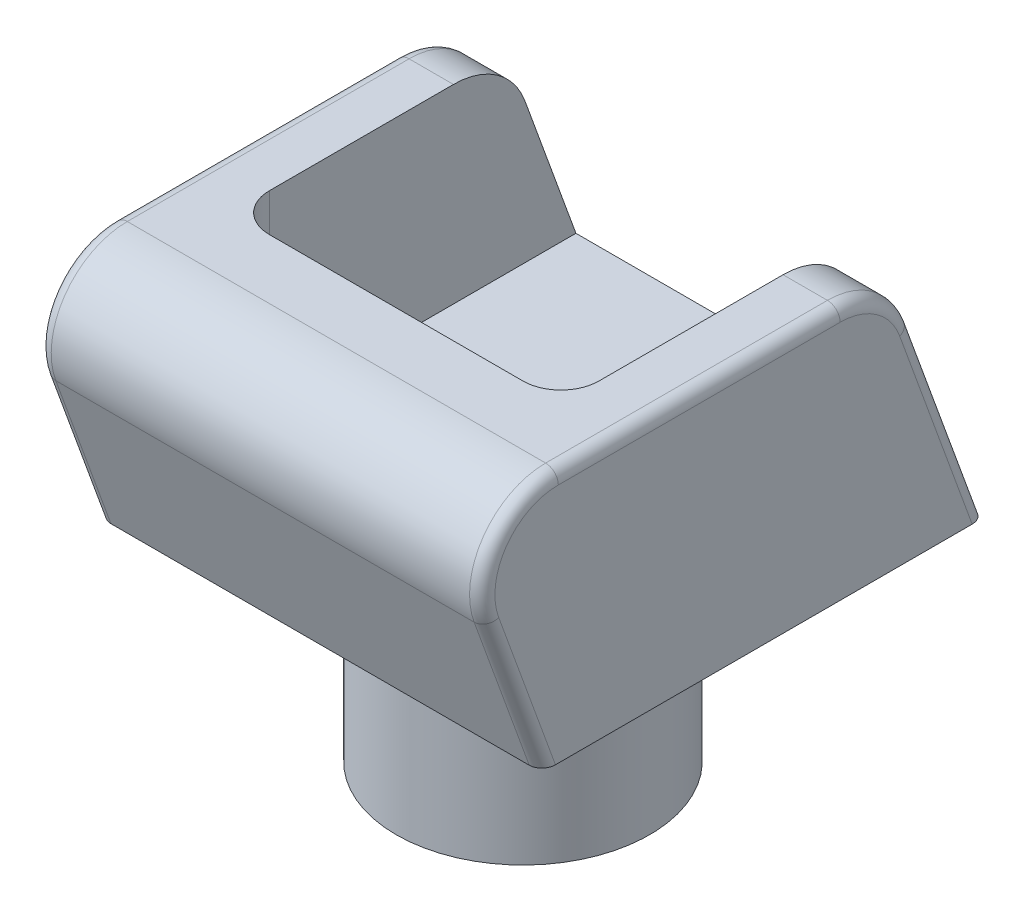
from build123d import *

# Parameters (mm, degrees)
BOSS_EXTRUDE1_DEPTH = 17.5
CUT_EXTRUDE1_DEPTH  = 13
FILLET1_R           = 6
FILLET2_R           = 1
FILLET3_R           = 3
SKETCH3_R           = 10
SKETCH3_R_2         = 7
BOSS_EXTRUDE2_DEPTH = 16
SKETCH4_R           = 1.5
CUT_EXTRUDE2_DEPTH  = 16
SKETCH5_W           = 0.094978633
SKETCH5_H           = 0.773397436
BOSS_EXTRUDE3_DEPTH = 0.3


with BuildPart() as part:
    # Sketch1 → Boss-Extrude1 (new, symmetric)
    with BuildSketch(Plane(origin=(0, 0, 0), x_dir=(0, 0, -1), z_dir=(1, 0, 0))):
        Polygon((0, 0), (-7.279404685, 20), (27.720595315, 20), (35, 0), align=None)
    extrude(amount=BOSS_EXTRUDE1_DEPTH, both=True)

    # Sketch2 → Cut-Extrude1 (cut, symmetric)
    with BuildSketch(Plane(origin=(0, 0, 0), x_dir=(0, 0, -1), z_dir=(1, 0, 0))):
        Polygon((6, 20), (6, 5), (33.180148829, 5), (27.720595315, 20), align=None)
    extrude(amount=CUT_EXTRUDE1_DEPTH, both=True, mode=Mode.SUBTRACT)

    # Fillet1
    fillet1_edges = [part.edges().sort_by_distance(p)[0] for p in [
        (-15.25, 20, -27.720595315),
        (0, 20, 7.279404685),
        (15.25, 20, -27.720595315),
    ]]
    fillet(fillet1_edges, radius=FILLET1_R)

    # Fillet2
    fillet2_edges = [part.edges().sort_by_distance(p)[0] for p in [
        (-17.5, 20, -12.40441672),
        (17.5, 20, -12.40441672),
        (-17.5, 5.97393957, 2.174336185),
        (-17.5, 17.441458618, 3.625428911),
        (-17.5, 18.914912266, -26.960808704),
        (17.5, 5.97393957, 2.174336185),
        (17.5, 17.441458618, 3.625428911),
        (17.5, 18.914912266, -26.960808704),
        (-17.5, 8.02606043, -32.078752905),
        (17.5, 8.02606043, -32.078752905),
    ]]
    fillet(fillet2_edges, radius=FILLET2_R)

    # Fillet3
    fillet3_edges = [part.edges().sort_by_distance(p)[0] for p in [
        (-13, 12.5, -6),
        (13, 12.5, -6),
    ]]
    fillet(fillet3_edges, radius=FILLET3_R)

    # Sketch3 → Boss-Extrude2 (add)
    with BuildSketch(Plane.XZ):
        with Locations(Location((0, -16, 0), (0, 0, 90))):
            Circle(SKETCH3_R)
        with Locations(Location((0, -16, 0), (0, 0, 270))):
            Circle(SKETCH3_R_2, mode=Mode.SUBTRACT)
    extrude(amount=BOSS_EXTRUDE2_DEPTH)

    # Sketch4 → Cut-Extrude2 (cut)
    with BuildSketch(Plane(origin=(0, 0, 0), x_dir=(0, 0, -1), z_dir=(1, 0, 0))):
        with Locations((16, -8)):
            Circle(SKETCH4_R)
    extrude(amount=-CUT_EXTRUDE2_DEPTH, mode=Mode.SUBTRACT)

    # Sketch5 → Boss-Extrude3 (add)
    # profile 1 of 33: a face of its own
    with BuildSketch(Plane.ZY.offset(17.5)):
        with BuildLine():
            Line((-28.939739067, 1.362925027), (-28.939739067, 2.421258361))
            Line((-28.939739067, 2.421258361), (-28.726037144, 2.421258361))
            add(Edge.make_bspline(
                [(-28.726037144, 2.421258361), (-28.707450093, 2.421124536), (-28.671540007, 2.420865987), (-28.619647672, 2.419226662), (-28.571634486, 2.416326688), (-28.52765836, 2.412102569), (-28.487598565, 2.406915818), (-28.451567272, 2.400414506), (-28.419378171, 2.392737607), (-28.399581459, 2.386192435), (-28.390219837, 2.383097303)],
                knots=[0, 0, 0, 0, 1.314313732, 2.53924729, 3.670748893, 4.714932338, 5.66265055, 6.526160246, 7.303039223, 8, 8, 8, 8], degree=3))
            add(Edge.make_bspline(
                [(-28.390219837, 2.383097303), (-28.377974999, 2.378431352), (-28.353762995, 2.369205257), (-28.319289413, 2.351801328), (-28.286836268, 2.332082128), (-28.256229526, 2.310021665), (-28.228168324, 2.284995302), (-28.201556412, 2.258066136), (-28.177482436, 2.2282549), (-28.155436356, 2.196179844), (-28.135559145, 2.162218818), (-28.118281352, 2.126436536), (-28.103932168, 2.089014713), (-28.092020407, 2.050057418), (-28.08263255, 2.00947899), (-28.076227537, 1.967232178), (-28.072002976, 1.923483947), (-28.071578417, 1.893797859), (-28.071362999, 1.878735324)],
                knots=[0, 0, 0, 0, 0.984719456, 1.947108742, 2.898477687, 3.838006223, 4.779231079, 5.722358779, 6.681677486, 7.655904652, 8.64651281, 9.637519902, 10.640069247, 11.656948941, 12.698408672, 13.768548281, 14.867775369, 16, 16, 16, 16], degree=3))
            add(Edge.make_bspline(
                [(-28.071362999, 1.878735324), (-28.071553187, 1.865653949), (-28.071927972, 1.839875735), (-28.075293265, 1.801884321), (-28.080184676, 1.765019979), (-28.087757564, 1.729458256), (-28.096950705, 1.69488758), (-28.108732723, 1.661676402), (-28.122229646, 1.629520059), (-28.137968538, 1.598853346), (-28.155247005, 1.569799565), (-28.173789532, 1.54241125), (-28.193576342, 1.517079219), (-28.214796117, 1.493726758), (-28.237174641, 1.472389071), (-28.260858426, 1.452887914), (-28.285908587, 1.43560486), (-28.312212924, 1.419860758), (-28.340538802, 1.406126508), (-28.371422742, 1.394506005), (-28.404996455, 1.384876195), (-28.441177533, 1.376841662), (-28.480028489, 1.370468288), (-28.521587415, 1.366196736), (-28.565790457, 1.363308111), (-28.596143235, 1.363055201), (-28.611765977, 1.362925027)],
                knots=[0, 0, 0, 0, 1.105936401, 2.179363191, 3.223086493, 4.248585256, 5.251745608, 6.245858792, 7.225916811, 8.198733463, 9.158002045, 10.082870192, 10.993790845, 11.873723703, 12.748670949, 13.606408763, 14.465103618, 15.319838547, 16.196477973, 17.123216899, 18.106603292, 19.147568657, 20.255746949, 21.433717677, 22.679120308, 24, 24, 24, 24], degree=3))
            Line((-28.611765977, 1.362925027), (-28.939739067, 1.362925027))
        make_face()
        with BuildLine():
            Line((-28.844760435, 1.471472036), (-28.723281068, 1.471472036))
            add(Edge.make_bspline(
                [(-28.723281068, 1.471472036), (-28.705825108, 1.471547056), (-28.672250905, 1.471691346), (-28.623973368, 1.472957476), (-28.579862217, 1.475026348), (-28.539911189, 1.477921669), (-28.504142841, 1.481752417), (-28.472482422, 1.486023518), (-28.445033713, 1.491344652), (-28.428424097, 1.496167919), (-28.420748683, 1.498396782)],
                knots=[0, 0, 0, 0, 1.375205317, 2.645023457, 3.804390687, 4.853969522, 5.800190428, 6.637939096, 7.370582563, 8, 8, 8, 8], degree=3))
            add(Edge.make_bspline(
                [(-28.420748683, 1.498396782), (-28.411088107, 1.501799039), (-28.391997697, 1.50852229), (-28.364516988, 1.520786154), (-28.338888084, 1.535313161), (-28.314664338, 1.551460992), (-28.292189374, 1.569799187), (-28.271196843, 1.589928986), (-28.251729013, 1.611952835), (-28.23398702, 1.635843398), (-28.218109509, 1.661451979), (-28.204359875, 1.688526817), (-28.192309531, 1.716771257), (-28.18285148, 1.746619027), (-28.175438435, 1.77780329), (-28.170187684, 1.81032624), (-28.166917517, 1.844181804), (-28.166536079, 1.867208755), (-28.166341632, 1.87894733)],
                knots=[0, 0, 0, 0, 0.998632004, 1.973411704, 2.929992603, 3.868527914, 4.809262121, 5.754881198, 6.702106254, 7.672490631, 8.653608572, 9.636854334, 10.631411391, 11.644891563, 12.686317036, 13.754757253, 14.855430412, 16, 16, 16, 16], degree=3))
            add(Edge.make_bspline(
                [(-28.166341632, 1.87894733), (-28.16649684, 1.891324835), (-28.166801748, 1.915640552), (-28.170634218, 1.951318691), (-28.176234784, 1.985633078), (-28.18433366, 2.018586009), (-28.194654188, 2.050241772), (-28.207533996, 2.080425291), (-28.222249855, 2.109455335), (-28.239758721, 2.136661869), (-28.258934389, 2.162392404), (-28.280215319, 2.185964486), (-28.303263411, 2.20743181), (-28.327827282, 2.227128697), (-28.354599215, 2.244262714), (-28.382948545, 2.259589401), (-28.413291165, 2.272596587), (-28.434401194, 2.279514719), (-28.445129359, 2.28303053)],
                knots=[0, 0, 0, 0, 1.122418816, 2.205001699, 3.251619955, 4.274784885, 5.280384055, 6.268708349, 7.249350384, 8.229342522, 9.199999885, 10.157847722, 11.105861043, 12.055065948, 13.010012805, 13.98527497, 14.976112212, 16, 16, 16, 16], degree=3))
            add(Edge.make_bspline(
                [(-28.445129359, 2.28303053), (-28.454004586, 2.285484783), (-28.472875755, 2.290703198), (-28.503670069, 2.296395632), (-28.538327507, 2.301416517), (-28.577001941, 2.3056674), (-28.619649284, 2.308717614), (-28.666302338, 2.311007035), (-28.716981266, 2.312551184), (-28.752112651, 2.312656626), (-28.770346373, 2.312711352)],
                knots=[0, 0, 0, 0, 0.674548936, 1.434276114, 2.292660221, 3.240891867, 4.284742987, 5.42552168, 6.663806718, 8, 8, 8, 8], degree=3))
            Line((-28.770346373, 2.312711352), (-28.844760435, 2.312711352))
            Line((-28.844760435, 2.312711352), (-28.844760435, 1.471472036))
        make_face(mode=Mode.SUBTRACT)
    # profile 2 of 33: a face of its own
    with BuildSketch(Plane.ZY.offset(17.5)):
        with BuildLine():
            Line((-27.246660141, 1.607155797), (-27.162281803, 1.562846569))
            add(Edge.make_bspline(
                [(-27.162281803, 1.562846569), (-27.169005725, 1.550919656), (-27.182087817, 1.527714609), (-27.204585186, 1.495834022), (-27.228168503, 1.46715388), (-27.253902322, 1.442440389), (-27.281016725, 1.420895327), (-27.309662075, 1.402045557), (-27.339987503, 1.385983528), (-27.371994444, 1.372451216), (-27.405951689, 1.36204644), (-27.441941528, 1.354697307), (-27.480032909, 1.350154556), (-27.506142349, 1.349626859), (-27.519511704, 1.349356651)],
                knots=[0, 0, 0, 0, 1.120438281, 2.179929193, 3.190490725, 4.156257408, 5.095198341, 6.022838206, 6.959905092, 7.901321166, 8.864066838, 9.862729781, 10.905609505, 12, 12, 12, 12], degree=3))
            add(Edge.make_bspline(
                [(-27.519511704, 1.349356651), (-27.534371302, 1.349703535), (-27.563358072, 1.350380205), (-27.605552234, 1.356213879), (-27.645278868, 1.365730521), (-27.68253574, 1.379024863), (-27.717231612, 1.396389792), (-27.749435441, 1.417544207), (-27.779316584, 1.442379436), (-27.805933428, 1.471110599), (-27.829895269, 1.501857286), (-27.851039505, 1.533896327), (-27.868715918, 1.567147112), (-27.883094922, 1.601397961), (-27.894707822, 1.636432995), (-27.902801563, 1.672570987), (-27.907467225, 1.709714128), (-27.908182188, 1.734841179), (-27.908542486, 1.747503687)],
                knots=[0, 0, 0, 0, 1.145258523, 2.234067595, 3.276747158, 4.290159414, 5.277019952, 6.260822364, 7.254936242, 8.264827045, 9.274100331, 10.257902744, 11.220704747, 12.172965371, 13.118907548, 14.062713208, 15.023725156, 16, 16, 16, 16], degree=3))
            add(Edge.make_bspline(
                [(-27.908542486, 1.747503687), (-27.908222222, 1.759385695), (-27.907587501, 1.782934266), (-27.903586763, 1.817788371), (-27.896496446, 1.851663641), (-27.886766938, 1.884588224), (-27.874202633, 1.916506994), (-27.858831938, 1.947439375), (-27.840630909, 1.977352453), (-27.826578458, 1.996221972), (-27.819500018, 2.005726844)],
                knots=[0, 0, 0, 0, 1.024358464, 2.0301432, 3.019427413, 4.004406732, 4.986367066, 5.972626655, 6.978780325, 8, 8, 8, 8], degree=3))
            add(Edge.make_bspline(
                [(-27.819500018, 2.005726844), (-27.809912219, 2.017177669), (-27.791040338, 2.039716586), (-27.759122106, 2.06933127), (-27.724559904, 2.094139745), (-27.687786865, 2.114703807), (-27.648375598, 2.130328934), (-27.606855883, 2.141972893), (-27.562754956, 2.148497673), (-27.532605996, 2.14941928), (-27.517179639, 2.149890839)],
                knots=[0, 0, 0, 0, 1.030682036, 2.02871468, 2.997146059, 3.962720338, 4.930598197, 5.918074684, 6.934738563, 8, 8, 8, 8], degree=3))
            add(Edge.make_bspline(
                [(-27.517179639, 2.149890839), (-27.501320482, 2.149481401), (-27.470208432, 2.148678176), (-27.424841576, 2.141231641), (-27.381915359, 2.129422893), (-27.341446959, 2.112745437), (-27.303432273, 2.091228144), (-27.268118396, 2.06457573), (-27.234901391, 2.033606451), (-27.215576654, 2.009789957), (-27.205743007, 1.99767062)],
                knots=[0, 0, 0, 0, 1.056321875, 2.072262726, 3.055038591, 4.01806755, 4.982017516, 5.957941055, 6.960871419, 8, 8, 8, 8], degree=3))
            add(Edge.make_bspline(
                [(-27.205743007, 1.99767062), (-27.199052242, 1.988537633), (-27.185715249, 1.970332449), (-27.169009578, 1.940647361), (-27.154508175, 1.909589634), (-27.142917018, 1.876657234), (-27.133531264, 1.842240361), (-27.12674075, 1.806092973), (-27.122758508, 1.768225833), (-27.121975735, 1.742424708), (-27.121576674, 1.729271181)],
                knots=[0, 0, 0, 0, 0.94817472, 1.890038105, 2.849395472, 3.817997239, 4.812318967, 5.836947057, 6.897266129, 8, 8, 8, 8], degree=3))
            Line((-27.121576674, 1.729271181), (-27.813563854, 1.729271181))
            add(Edge.make_bspline(
                [(-27.813563854, 1.729271181), (-27.813098306, 1.719080803), (-27.812182825, 1.699041835), (-27.807914675, 1.669719717), (-27.80118707, 1.641787778), (-27.791731901, 1.615455524), (-27.780281688, 1.590379033), (-27.766255531, 1.566744322), (-27.749521904, 1.544659043), (-27.730857228, 1.523925647), (-27.710081511, 1.505462036), (-27.688224585, 1.48893638), (-27.664973436, 1.47508564), (-27.640511396, 1.463843149), (-27.614878023, 1.455041954), (-27.58806524, 1.449034303), (-27.56012581, 1.445010488), (-27.541080124, 1.444563065), (-27.531384033, 1.444335284)],
                knots=[0, 0, 0, 0, 1.094153842, 2.151609401, 3.174256925, 4.172055639, 5.149267565, 6.128595816, 7.11444997, 8.118368179, 9.117203808, 10.09244225, 11.054858984, 12.015122123, 12.976791628, 13.957293641, 14.960065497, 16, 16, 16, 16], degree=3))
            add(Edge.make_bspline(
                [(-27.531384033, 1.444335284), (-27.521904043, 1.444519149), (-27.503093924, 1.444883972), (-27.475081094, 1.448431478), (-27.447522237, 1.454167728), (-27.420531416, 1.461996368), (-27.394656422, 1.471544606), (-27.370694077, 1.483066185), (-27.348656488, 1.495811465), (-27.328059215, 1.510389153), (-27.308080605, 1.528232105), (-27.288261805, 1.550498144), (-27.267011484, 1.576831754), (-27.253709869, 1.596651515), (-27.246660141, 1.607155797)],
                knots=[0, 0, 0, 0, 0.99110716, 1.966546729, 2.947904876, 3.932708344, 4.903319531, 5.828989031, 6.710028674, 7.56322171, 8.463672341, 9.504779593, 10.677557249, 12, 12, 12, 12], degree=3))
        make_face()
        with BuildLine():
            add(Edge.make_bspline(
                [(-27.216555307, 1.824249814), (-27.220031667, 1.836847873), (-27.226722542, 1.861095082), (-27.240703537, 1.894671732), (-27.25644898, 1.924513074), (-27.275082217, 1.950390725), (-27.29619407, 1.97337274), (-27.320579637, 1.993456455), (-27.347925729, 2.01142316), (-27.378090993, 2.026588321), (-27.410035056, 2.039496921), (-27.443480262, 2.04815261), (-27.477606307, 2.054082163), (-27.500688342, 2.054634343), (-27.512303504, 2.054912207)],
                knots=[0, 0, 0, 0, 1.154881502, 2.222775134, 3.210006277, 4.132804581, 5.035138423, 5.962687519, 6.919655026, 7.923214229, 8.944639381, 9.960483929, 10.97369054, 12, 12, 12, 12], degree=3))
            add(Edge.make_bspline(
                [(-27.512303504, 2.054912207), (-27.521782977, 2.054727249), (-27.540521902, 2.054361626), (-27.568129606, 2.050893278), (-27.594642277, 2.045160182), (-27.620255543, 2.037308873), (-27.644633758, 2.026843891), (-27.668278366, 2.014572297), (-27.690588153, 1.999591865), (-27.704540401, 1.988174307), (-27.711589027, 1.982406197)],
                knots=[0, 0, 0, 0, 1.04873581, 2.073130211, 3.073294108, 4.04793562, 5.032784715, 6.005352987, 6.992311501, 8, 8, 8, 8], degree=3))
            add(Edge.make_bspline(
                [(-27.711589027, 1.982406197), (-27.716636758, 1.977841964), (-27.726852134, 1.968605067), (-27.740501768, 1.952690998), (-27.753570816, 1.935530406), (-27.765464563, 1.916466762), (-27.776373738, 1.895717145), (-27.786582112, 1.873456574), (-27.795770384, 1.849516128), (-27.800939922, 1.832833033), (-27.803599578, 1.824249814)],
                knots=[0, 0, 0, 0, 0.879870761, 1.780643979, 2.707998968, 3.669668524, 4.684282772, 5.740141944, 6.837334558, 8, 8, 8, 8], degree=3))
            Line((-27.803599578, 1.824249814), (-27.216555307, 1.824249814))
        make_face(mode=Mode.SUBTRACT)
    # profile 3 of 33: a face of its own
    with BuildSketch(Plane.ZY.offset(17.5)):
        with BuildLine():
            Line((-26.565273256, 2.03985979), (-26.629723042, 1.973501951))
            add(Edge.make_bspline(
                [(-26.629723042, 1.973501951), (-26.63528398, 1.97994664), (-26.646004814, 1.992371243), (-26.663008142, 2.008983165), (-26.679948613, 2.022934097), (-26.696594326, 2.034712518), (-26.71336385, 2.043617379), (-26.730060394, 2.050117016), (-26.746701246, 2.054139228), (-26.757824642, 2.054657642), (-26.763286744, 2.054912207)],
                knots=[0, 0, 0, 0, 1.26578478, 2.440284043, 3.530471711, 4.527705817, 5.468200915, 6.346673037, 7.188140097, 8, 8, 8, 8], degree=3))
            add(Edge.make_bspline(
                [(-26.763286744, 2.054912207), (-26.769981274, 2.054587186), (-26.783155161, 2.05394759), (-26.802031539, 2.047563291), (-26.819554704, 2.037763506), (-26.83472122, 2.023863482), (-26.847568685, 2.007908572), (-26.856946631, 1.990069207), (-26.862681583, 1.970883727), (-26.863408729, 1.957569937), (-26.863777529, 1.950817322)],
                knots=[0, 0, 0, 0, 0.99966794, 1.967205029, 2.953328237, 3.988086729, 5.028030931, 6.008226631, 6.989793394, 8, 8, 8, 8], degree=3))
            add(Edge.make_bspline(
                [(-26.863777529, 1.950817322), (-26.863441641, 1.944705585), (-26.86277081, 1.932499339), (-26.857555743, 1.914493148), (-26.849250526, 1.896937806), (-26.841488348, 1.88618426), (-26.8374888, 1.880643377)],
                knots=[0, 0, 0, 0, 0.960159726, 1.917612774, 2.927026955, 4, 4, 4, 4], degree=3))
            add(Edge.make_bspline(
                [(-26.8374888, 1.880643377), (-26.835080792, 1.877684705), (-26.829955648, 1.871387545), (-26.820337359, 1.86264757), (-26.80944484, 1.852988842), (-26.796345716, 1.84333175), (-26.781604334, 1.833162157), (-26.764901027, 1.82288056), (-26.746765879, 1.811703222), (-26.733782455, 1.804614071), (-26.727033739, 1.800929167)],
                knots=[0, 0, 0, 0, 0.66740084, 1.420478572, 2.27185888, 3.217733974, 4.268547843, 5.408967954, 6.65319498, 8, 8, 8, 8], degree=3))
            add(Edge.make_bspline(
                [(-26.727033739, 1.800929167), (-26.718804872, 1.796319399), (-26.702909409, 1.787414845), (-26.680323739, 1.773593101), (-26.659826229, 1.759855504), (-26.641243206, 1.746348971), (-26.624932231, 1.732695604), (-26.610398425, 1.719418735), (-26.598004301, 1.706117206), (-26.59106347, 1.696824097), (-26.587745878, 1.692382159)],
                knots=[0, 0, 0, 0, 1.27191281, 2.456916733, 3.569705269, 4.599008579, 5.553216877, 6.436649441, 7.252746552, 8, 8, 8, 8], degree=3))
            add(Edge.make_bspline(
                [(-26.587745878, 1.692382159), (-26.582239362, 1.683411699), (-26.571280372, 1.665558819), (-26.559772277, 1.636161818), (-26.55310167, 1.604983166), (-26.552175713, 1.583655566), (-26.551704879, 1.572810845)],
                knots=[0, 0, 0, 0, 0.995354457, 1.980940102, 2.973342416, 4, 4, 4, 4], degree=3))
            add(Edge.make_bspline(
                [(-26.551704879, 1.572810845), (-26.551922453, 1.565169936), (-26.552351205, 1.550112691), (-26.555332096, 1.527937636), (-26.560458958, 1.506730281), (-26.56744207, 1.486260517), (-26.57687163, 1.466920552), (-26.587922988, 1.448222448), (-26.601189925, 1.430570678), (-26.616336603, 1.413988421), (-26.632920836, 1.398843445), (-26.650611978, 1.38553144), (-26.669431815, 1.374472057), (-26.689245871, 1.365320393), (-26.710099167, 1.358042611), (-26.731994961, 1.353004178), (-26.754863656, 1.349988605), (-26.77041505, 1.349569966), (-26.778339161, 1.349356651)],
                knots=[0, 0, 0, 0, 1.032770009, 2.035186124, 3.017557409, 3.978232242, 4.952395191, 5.920591857, 6.910227898, 7.931268572, 8.952309245, 9.941945286, 10.918353717, 11.897095711, 12.887975737, 13.898235213, 14.929059601, 16, 16, 16, 16], degree=3))
            add(Edge.make_bspline(
                [(-26.778339161, 1.349356651), (-26.789033521, 1.349656825), (-26.810273644, 1.350253001), (-26.841687917, 1.355848882), (-26.87238586, 1.364556061), (-26.902135169, 1.376565403), (-26.930270541, 1.391730023), (-26.956012511, 1.409891747), (-26.979450501, 1.430450627), (-26.992791027, 1.446208578), (-26.99946129, 1.454087554)],
                knots=[0, 0, 0, 0, 1.013940152, 2.01379169, 3.017749504, 4.037548394, 5.051665909, 6.043208538, 7.021604269, 8, 8, 8, 8], degree=3))
            Line((-26.99946129, 1.454087554), (-26.936495545, 1.52574554))
            add(Edge.make_bspline(
                [(-26.936495545, 1.52574554), (-26.930516743, 1.519288266), (-26.918925934, 1.506769864), (-26.900389613, 1.490101313), (-26.881527271, 1.476130929), (-26.862527258, 1.464445897), (-26.843108325, 1.455442382), (-26.823379294, 1.449116997), (-26.803380294, 1.44505173), (-26.789947887, 1.444574487), (-26.783215296, 1.444335284)],
                knots=[0, 0, 0, 0, 1.179806542, 2.287233372, 3.337373186, 4.324005949, 5.273901747, 6.200048787, 7.097828587, 8, 8, 8, 8], degree=3))
            add(Edge.make_bspline(
                [(-26.783215296, 1.444335284), (-26.774047733, 1.444749795), (-26.756135852, 1.445559681), (-26.730480715, 1.452912706), (-26.706792607, 1.464442477), (-26.686223643, 1.48079666), (-26.668715132, 1.499833226), (-26.656036851, 1.521276305), (-26.648091436, 1.544496579), (-26.647158289, 1.560593013), (-26.646683512, 1.568782733)],
                knots=[0, 0, 0, 0, 1.072336372, 2.095165389, 3.102688358, 4.141489647, 5.156069229, 6.117746104, 7.042326257, 8, 8, 8, 8], degree=3))
            add(Edge.make_bspline(
                [(-26.646683512, 1.568782733), (-26.647011987, 1.575528737), (-26.647660516, 1.588847818), (-26.652753601, 1.608124707), (-26.66080082, 1.626409466), (-26.668724607, 1.637110621), (-26.672760235, 1.642560778)],
                knots=[0, 0, 0, 0, 1.013901739, 2.00181326, 2.98231254, 4, 4, 4, 4], degree=3))
            add(Edge.make_bspline(
                [(-26.672760235, 1.642560778), (-26.675186054, 1.645292899), (-26.680470364, 1.651244447), (-26.690163259, 1.659839649), (-26.701769203, 1.669104027), (-26.715418728, 1.678880483), (-26.731139351, 1.689040061), (-26.748994788, 1.699529461), (-26.768740431, 1.710846892), (-26.782701551, 1.718351883), (-26.789999484, 1.722274987)],
                knots=[0, 0, 0, 0, 0.615000592, 1.339693406, 2.178160186, 3.116406724, 4.166410947, 5.330106347, 6.604359322, 8, 8, 8, 8], degree=3))
            add(Edge.make_bspline(
                [(-26.789999484, 1.722274987), (-26.797875492, 1.726671344), (-26.813149585, 1.735197282), (-26.834784123, 1.748476668), (-26.854302013, 1.761983201), (-26.872172901, 1.774959227), (-26.887945396, 1.788088893), (-26.901557361, 1.801386776), (-26.913544714, 1.814316581), (-26.920181194, 1.823477907), (-26.92335118, 1.827853914)],
                knots=[0, 0, 0, 0, 1.262093308, 2.447601706, 3.550203992, 4.582594899, 5.537233252, 6.418365656, 7.244515135, 8, 8, 8, 8], degree=3))
            add(Edge.make_bspline(
                [(-26.92335118, 1.827853914), (-26.928833528, 1.836666992), (-26.93980014, 1.85429623), (-26.950448543, 1.883721065), (-26.957767985, 1.914698499), (-26.958421851, 1.936072857), (-26.958756162, 1.947001216)],
                knots=[0, 0, 0, 0, 0.985009483, 1.970363186, 2.962279964, 4, 4, 4, 4], degree=3))
            add(Edge.make_bspline(
                [(-26.958756162, 1.947001216), (-26.958594631, 1.954145086), (-26.958278493, 1.968126653), (-26.955755411, 1.988670058), (-26.951161727, 2.00818819), (-26.945399881, 2.02697417), (-26.937391925, 2.044664089), (-26.927822806, 2.061493848), (-26.916578037, 2.077440185), (-26.903623042, 2.092257799), (-26.88937889, 2.105716571), (-26.873989281, 2.117448538), (-26.857800332, 2.127459269), (-26.8407435, 2.135854924), (-26.822654928, 2.142205342), (-26.803661054, 2.14657698), (-26.783800324, 2.14949653), (-26.770223079, 2.14975751), (-26.763286744, 2.149890839)],
                knots=[0, 0, 0, 0, 1.087655834, 2.128696564, 3.144119009, 4.137814668, 5.115653402, 6.093965665, 7.082169637, 8.081268856, 9.086088321, 10.061021666, 11.022561449, 11.980240094, 12.950172527, 13.934149372, 14.944599409, 16, 16, 16, 16], degree=3))
            add(Edge.make_bspline(
                [(-26.763286744, 2.149890839), (-26.755064382, 2.149556908), (-26.738465415, 2.14888278), (-26.713562944, 2.143528917), (-26.688697148, 2.134719621), (-26.663804135, 2.12255295), (-26.639066262, 2.106808919), (-26.614265927, 2.087780298), (-26.589105403, 2.065592274), (-26.573394804, 2.048628937), (-26.565273256, 2.03985979)],
                knots=[0, 0, 0, 0, 0.845714091, 1.707292901, 2.609013841, 3.555613372, 4.552488639, 5.621697636, 6.770543573, 8, 8, 8, 8], degree=3))
        make_face()
    # profile 4 of 33: a face of its own
    with BuildSketch(Plane.ZY.offset(17.5)):
        with BuildLine():
            add(Edge.make_bspline(
                [(-26.328250686, 2.461963489), (-26.322356883, 2.461690091), (-26.310815686, 2.461154724), (-26.294126293, 2.456570182), (-26.27892953, 2.448799087), (-26.265450073, 2.438373088), (-26.253883431, 2.426111708), (-26.245785454, 2.411820892), (-26.240580753, 2.396381732), (-26.239952238, 2.385612407), (-26.23963223, 2.380129221)],
                knots=[0, 0, 0, 0, 1.055194115, 2.066272739, 3.074728998, 4.095836921, 5.109056067, 6.073838105, 7.019297344, 8, 8, 8, 8], degree=3))
            add(Edge.make_bspline(
                [(-26.23963223, 2.380129221), (-26.239959454, 2.374788371), (-26.240606339, 2.364230143), (-26.245781434, 2.34905864), (-26.253952444, 2.334966393), (-26.265442656, 2.322728821), (-26.278931495, 2.312308586), (-26.294125771, 2.304535962), (-26.310815823, 2.299951826), (-26.32235693, 2.299416403), (-26.328250686, 2.299142976)],
                knots=[0, 0, 0, 0, 0.96129708, 1.900370562, 2.859976407, 3.87933698, 4.906634145, 5.921202961, 6.938410037, 8, 8, 8, 8], degree=3))
            add(Edge.make_bspline(
                [(-26.328250686, 2.299142976), (-26.334077045, 2.299405963), (-26.345417293, 2.299917832), (-26.36185679, 2.304625909), (-26.376923976, 2.312311246), (-26.390429723, 2.322660592), (-26.401687424, 2.335041549), (-26.409881441, 2.34905004), (-26.415044585, 2.364232332), (-26.415693079, 2.374789106), (-26.416021119, 2.380129221)],
                knots=[0, 0, 0, 0, 1.054934014, 2.053291228, 3.073705704, 4.106921865, 5.123545215, 6.088680038, 7.033164197, 8, 8, 8, 8], degree=3))
            add(Edge.make_bspline(
                [(-26.416021119, 2.380129221), (-26.415700266, 2.385611644), (-26.415070092, 2.39637947), (-26.409877571, 2.411829635), (-26.401755677, 2.426035946), (-26.390422268, 2.438441276), (-26.37692596, 2.448796443), (-26.361856278, 2.45648024), (-26.345417428, 2.461188716), (-26.334077091, 2.46170053), (-26.328250686, 2.461963489)],
                knots=[0, 0, 0, 0, 0.98631895, 1.937192651, 2.907499808, 3.917963147, 4.944918757, 5.95915025, 6.951458133, 8, 8, 8, 8], degree=3))
        make_face()
    # profile 5 of 33: a face of its own
    with BuildSketch(Plane.ZY.offset(17.5)):
        with Locations((-26.327826675, 1.749623745)):
            Rectangle(SKETCH5_W, SKETCH5_H)
    # profile 6 of 33: a face of its own
    with BuildSketch(Plane.ZY.offset(17.5)):
        with BuildLine():
            Line((-25.371256162, 2.136322463), (-25.276277529, 2.136322463))
            Line((-25.276277529, 2.136322463), (-25.276277529, 1.522565452))
            add(Edge.make_bspline(
                [(-25.276277529, 1.522565452), (-25.276361301, 1.509491227), (-25.276523002, 1.484254823), (-25.277687463, 1.44776401), (-25.280143001, 1.414058789), (-25.282927531, 1.38298544), (-25.286933085, 1.354687992), (-25.291824511, 1.329082009), (-25.297338633, 1.306142917), (-25.302182841, 1.292014215), (-25.304474311, 1.285330877)],
                knots=[0, 0, 0, 0, 1.307562039, 2.523909702, 3.650326591, 4.686913197, 5.643429486, 6.506965704, 7.293745905, 8, 8, 8, 8], degree=3))
            add(Edge.make_bspline(
                [(-25.304474311, 1.285330877), (-25.307857723, 1.276643496), (-25.314523387, 1.259528481), (-25.327007376, 1.23526715), (-25.340987628, 1.212423361), (-25.356955383, 1.191124417), (-25.374838436, 1.171477242), (-25.394215458, 1.153054985), (-25.415463826, 1.136247391), (-25.438571389, 1.121344456), (-25.463005473, 1.107922656), (-25.488752033, 1.096297147), (-25.515665884, 1.086171363), (-25.543999854, 1.078586803), (-25.57330971, 1.072014638), (-25.603940124, 1.067737554), (-25.635712136, 1.064826515), (-25.657315859, 1.064557326), (-25.668276394, 1.064420754)],
                knots=[0, 0, 0, 0, 0.981931301, 1.934503488, 2.87077864, 3.801706999, 4.735015492, 5.667491629, 6.616593066, 7.585388521, 8.561939025, 9.551802639, 10.560317337, 11.588439944, 12.640189604, 13.723962949, 14.845264515, 16, 16, 16, 16], degree=3))
            add(Edge.make_bspline(
                [(-25.668276394, 1.064420754), (-25.68426773, 1.064679739), (-25.715503107, 1.065185606), (-25.761043188, 1.071079288), (-25.804294163, 1.079411205), (-25.844684534, 1.092022132), (-25.881959063, 1.107454746), (-25.915863188, 1.125172743), (-25.946092546, 1.145489511), (-25.973344228, 1.168621835), (-25.997940376, 1.19612752), (-26.021080771, 1.228542408), (-26.043354436, 1.266360253), (-26.05640781, 1.294116622), (-26.063243341, 1.308651523)],
                knots=[0, 0, 0, 0, 1.157897085, 2.2616841, 3.32207898, 4.345638746, 5.321241055, 6.241986252, 7.112515963, 7.955008012, 8.825025602, 9.77857164, 10.836726669, 12, 12, 12, 12], degree=3))
            Line((-26.063243341, 1.308651523), (-25.968264709, 1.308651523))
            add(Edge.make_bspline(
                [(-25.968264709, 1.308651523), (-25.960625898, 1.29652427), (-25.945692963, 1.272816984), (-25.917768541, 1.242121339), (-25.887165676, 1.215888774), (-25.852851581, 1.194749088), (-25.81468348, 1.178810651), (-25.772638411, 1.167448597), (-25.72637424, 1.160646154), (-25.694165161, 1.159826311), (-25.677392647, 1.159399386)],
                knots=[0, 0, 0, 0, 0.997731894, 1.950442991, 2.880492273, 3.800895997, 4.748200782, 5.754801363, 6.83083817, 8, 8, 8, 8], degree=3))
            add(Edge.make_bspline(
                [(-25.677392647, 1.159399386), (-25.660832182, 1.159831836), (-25.628905264, 1.160665556), (-25.582994411, 1.167451633), (-25.541085941, 1.178813124), (-25.503421309, 1.194720898), (-25.470444922, 1.214209473), (-25.442017487, 1.235980924), (-25.418992787, 1.260528513), (-25.403506961, 1.283141107), (-25.393880779, 1.303286974), (-25.387750841, 1.320629307), (-25.382769427, 1.340239582), (-25.378602666, 1.362052055), (-25.375164319, 1.386097889), (-25.372986304, 1.412432066), (-25.371412166, 1.440994735), (-25.371309365, 1.460798613), (-25.371256162, 1.471048024)],
                knots=[0, 0, 0, 0, 1.570740765, 3.028230971, 4.391408896, 5.680370741, 6.894727393, 8.017376726, 9.065722033, 10.075533815, 10.603371122, 11.180248986, 11.817768598, 12.521299649, 13.286540596, 14.121245857, 15.027658897, 16, 16, 16, 16], degree=3))
            Line((-25.371256162, 1.471048024), (-25.371256162, 1.511117135))
            add(Edge.make_bspline(
                [(-25.371256162, 1.511117135), (-25.380896404, 1.499644257), (-25.400007321, 1.476900304), (-25.433011393, 1.447097143), (-25.469060318, 1.421429194), (-25.508092722, 1.400377845), (-25.5491525, 1.383540843), (-25.591794937, 1.371765233), (-25.635637772, 1.364157359), (-25.665347351, 1.363338718), (-25.680360729, 1.362925027)],
                knots=[0, 0, 0, 0, 1.012485704, 2.007162095, 2.997754123, 3.998611389, 4.999708251, 5.992315798, 6.98544096, 8, 8, 8, 8], degree=3))
            add(Edge.make_bspline(
                [(-25.680360729, 1.362925027), (-25.68920122, 1.363080762), (-25.706777584, 1.363390387), (-25.732889614, 1.366099351), (-25.758616318, 1.370029923), (-25.783897695, 1.375799786), (-25.808770226, 1.383205618), (-25.833192807, 1.392463537), (-25.857363183, 1.402930489), (-25.880842005, 1.415259408), (-25.903395431, 1.428976106), (-25.924853346, 1.44383477), (-25.945103357, 1.459757634), (-25.963952724, 1.476901708), (-25.981376722, 1.495242181), (-25.997609701, 1.514583541), (-26.012383232, 1.535195866), (-26.026000471, 1.556703303), (-26.037810731, 1.579249106), (-26.048177672, 1.602344387), (-26.057191468, 1.625939764), (-26.064377673, 1.650114233), (-26.069866224, 1.674852553), (-26.073951459, 1.700114199), (-26.076268584, 1.725976959), (-26.076629906, 1.743400557), (-26.076811717, 1.752167816)],
                knots=[0, 0, 0, 0, 1.028754217, 2.045334182, 3.052854819, 4.056607503, 5.061168794, 6.071104265, 7.095078842, 8.125279047, 9.155117945, 10.165957491, 11.161587969, 12.151493252, 13.128948131, 14.104219989, 15.088194871, 16.07871515, 17.064853787, 18.047899887, 19.02414258, 20.002704429, 20.980574569, 21.971845993, 22.979467364, 24, 24, 24, 24], degree=3))
            add(Edge.make_bspline(
                [(-26.076811717, 1.752167816), (-26.076654731, 1.7609378), (-26.076341367, 1.7784438), (-26.073634761, 1.80441209), (-26.069773904, 1.830032658), (-26.06366346, 1.855041419), (-26.056308792, 1.87972319), (-26.047199998, 1.903895661), (-26.036248135, 1.927566196), (-26.023847568, 1.950752323), (-26.009912616, 1.973142912), (-25.994632556, 1.99440835), (-25.977988942, 2.014392154), (-25.960211386, 2.033295929), (-25.941082823, 2.050937286), (-25.920613146, 2.067273406), (-25.899004132, 2.082578123), (-25.876188809, 2.096521313), (-25.852519218, 2.108853088), (-25.828596706, 2.120105468), (-25.804104383, 2.129036024), (-25.779498877, 2.136904913), (-25.754346855, 2.142479365), (-25.728956715, 2.1467799), (-25.703241532, 2.149399947), (-25.686020061, 2.149726997), (-25.677392647, 2.149890839)],
                knots=[0, 0, 0, 0, 1.008818848, 2.013730394, 3.001654427, 3.987803273, 4.973046549, 5.963777569, 6.957074694, 7.972068341, 8.987420212, 9.989399531, 10.982630087, 11.977756091, 12.973280677, 13.973972381, 14.989194003, 16.018387222, 17.047741039, 18.059210846, 19.057554164, 20.045176975, 21.029480261, 22.018708529, 23.007435371, 24, 24, 24, 24], degree=3))
            add(Edge.make_bspline(
                [(-25.677392647, 2.149890839), (-25.663165339, 2.149480607), (-25.635070778, 2.148670525), (-25.593725927, 2.142314131), (-25.553829107, 2.132180132), (-25.515155183, 2.117661119), (-25.477389117, 2.097840036), (-25.440655378, 2.071731574), (-25.404847688, 2.039101542), (-25.382750344, 2.014078652), (-25.371256162, 2.001062714)],
                knots=[0, 0, 0, 0, 0.96728863, 1.910097829, 2.838038873, 3.762875196, 4.71315279, 5.730631239, 6.819562287, 8, 8, 8, 8], degree=3))
            Line((-25.371256162, 2.001062714), (-25.371256162, 2.136322463))
        make_face()
        with BuildLine():
            add(Edge.make_bspline(
                [(-25.669760435, 2.054912207), (-25.683649005, 2.05444017), (-25.711145429, 2.053505638), (-25.751449285, 2.045527404), (-25.790358738, 2.033025191), (-25.827129903, 2.015141591), (-25.861573244, 1.993341666), (-25.892136344, 1.966931627), (-25.918868307, 1.936770277), (-25.941481243, 1.903130321), (-25.959482394, 1.866837871), (-25.972225762, 1.828583435), (-25.98046565, 1.78898514), (-25.981375106, 1.761960567), (-25.981833085, 1.74835171)],
                knots=[0, 0, 0, 0, 1.026226791, 2.031711442, 3.026614839, 4.04107745, 5.047145931, 6.032893242, 7.017642609, 8.019221815, 9.021877557, 10.003543541, 10.994637589, 12, 12, 12, 12], degree=3))
            add(Edge.make_bspline(
                [(-25.981833085, 1.74835171), (-25.98161363, 1.738090935), (-25.981182026, 1.71791099), (-25.977032277, 1.688296437), (-25.970325176, 1.660090246), (-25.960819163, 1.633290714), (-25.94904061, 1.607744121), (-25.934226251, 1.583626448), (-25.916793695, 1.560916216), (-25.896879388, 1.539781395), (-25.874933672, 1.520531531), (-25.851130486, 1.503616933), (-25.825502113, 1.489782786), (-25.798678863, 1.47782639), (-25.770009896, 1.46909391), (-25.739908149, 1.462429803), (-25.70816066, 1.458617155), (-25.686518729, 1.458144595), (-25.675484594, 1.45790366)],
                knots=[0, 0, 0, 0, 1.039728707, 2.044842319, 3.024901384, 3.974314358, 4.923051295, 5.871625912, 6.837440708, 7.820715446, 8.810779094, 9.792721783, 10.773906224, 11.758876063, 12.764959493, 13.806266761, 14.881525401, 16, 16, 16, 16], degree=3))
            add(Edge.make_bspline(
                [(-25.675484594, 1.45790366), (-25.664307457, 1.45813577), (-25.642450685, 1.45858966), (-25.610528045, 1.462491432), (-25.58028005, 1.468787601), (-25.551734435, 1.477726897), (-25.524783419, 1.489133235), (-25.499729762, 1.503567879), (-25.476036265, 1.520006648), (-25.454459446, 1.539181233), (-25.434948567, 1.560313125), (-25.417945454, 1.583307652), (-25.403457038, 1.607818809), (-25.391459266, 1.633843832), (-25.382299783, 1.661584973), (-25.376155733, 1.69097288), (-25.371859884, 1.721866761), (-25.371460461, 1.743036033), (-25.371256162, 1.753863863)],
                knots=[0, 0, 0, 0, 1.121943988, 2.193949579, 3.223793937, 4.220241907, 5.192961521, 6.155822191, 7.11847367, 8.083710714, 9.04790392, 10.001595906, 10.949595423, 11.902125208, 12.873731292, 13.87582262, 14.913508608, 16, 16, 16, 16], degree=3))
            add(Edge.make_bspline(
                [(-25.371256162, 1.753863863), (-25.371661221, 1.767960214), (-25.372452566, 1.79549953), (-25.379920516, 1.835627529), (-25.391961389, 1.8733552), (-25.408848383, 1.908563221), (-25.43000961, 1.940878537), (-25.455497557, 1.969702652), (-25.484872666, 1.995072673), (-25.518050539, 2.016208555), (-25.553745838, 2.033282627), (-25.591096295, 2.04609202), (-25.630046459, 2.053347444), (-25.656446254, 2.054387617), (-25.669760435, 2.054912207)],
                knots=[0, 0, 0, 0, 1.070913519, 2.092188694, 3.091357305, 4.074328408, 5.051968682, 6.018948707, 6.99050112, 7.9935919, 9.000589572, 9.992915277, 10.987769056, 12, 12, 12, 12], degree=3))
        make_face(mode=Mode.SUBTRACT)
    # profile 7 of 33: a face of its own
    with BuildSketch(Plane.ZY.offset(17.5)):
        with BuildLine():
            Line((-25.059183512, 2.136322463), (-24.964204879, 2.136322463))
            Line((-24.964204879, 2.136322463), (-24.964204879, 1.996822597))
            add(Edge.make_bspline(
                [(-24.964204879, 1.996822597), (-24.954063737, 2.009475039), (-24.934384497, 2.034027545), (-24.90161114, 2.066297814), (-24.866975246, 2.092890775), (-24.830688926, 2.114088827), (-24.79270292, 2.13006864), (-24.753248777, 2.141609291), (-24.712090282, 2.148529227), (-24.68410056, 2.149433416), (-24.669940723, 2.149890839)],
                knots=[0, 0, 0, 0, 1.12780773, 2.188550248, 3.19190651, 4.159438251, 5.104880172, 6.052711206, 7.014878035, 8, 8, 8, 8], degree=3))
            add(Edge.make_bspline(
                [(-24.669940723, 2.149890839), (-24.655628841, 2.149363126), (-24.627617036, 2.148330262), (-24.586832479, 2.140160929), (-24.548740524, 2.126207483), (-24.513476992, 2.107093357), (-24.481688525, 2.083324257), (-24.453771248, 2.05563288), (-24.430680457, 2.023781255), (-24.415199349, 1.994231634), (-24.405001356, 1.968018594), (-24.398581102, 1.945567791), (-24.393128876, 1.920555397), (-24.388402133, 1.893056998), (-24.385203816, 1.862879926), (-24.382681266, 1.830147886), (-24.380873423, 1.79487148), (-24.380801696, 1.77047338), (-24.380764709, 1.757891975)],
                knots=[0, 0, 0, 0, 1.235846778, 2.418850247, 3.575807741, 4.728682307, 5.871620074, 6.994088408, 8.11269785, 9.256955736, 9.865816715, 10.540099792, 11.271859618, 12.076849838, 12.949306005, 13.892391288, 14.913166135, 16, 16, 16, 16], degree=3))
            Line((-24.380764709, 1.757891975), (-24.380764709, 1.362925027))
            Line((-24.380764709, 1.362925027), (-24.475743341, 1.362925027))
            Line((-24.475743341, 1.362925027), (-24.475743341, 1.726727111))
            add(Edge.make_bspline(
                [(-24.475743341, 1.726727111), (-24.475801763, 1.737256755), (-24.475913516, 1.757398172), (-24.476265985, 1.786235948), (-24.477115617, 1.812387842), (-24.478309512, 1.835791332), (-24.48005698, 1.856423944), (-24.481878109, 1.874327702), (-24.484105138, 1.889479873), (-24.486089638, 1.898601219), (-24.486979652, 1.902691988)],
                knots=[0, 0, 0, 0, 1.430800155, 2.736877192, 3.918605307, 4.986035426, 5.920637409, 6.731861385, 7.431261377, 8, 8, 8, 8], degree=3))
            add(Edge.make_bspline(
                [(-24.486979652, 1.902691988), (-24.490192611, 1.914699894), (-24.496376561, 1.937811398), (-24.511657075, 1.969160547), (-24.530953268, 1.995829999), (-24.554508094, 2.017654865), (-24.582094029, 2.034639856), (-24.613634522, 2.046424838), (-24.648825206, 2.053795757), (-24.673576412, 2.054529676), (-24.686477182, 2.054912207)],
                knots=[0, 0, 0, 0, 1.084156227, 2.086665306, 3.027808233, 3.945421172, 4.874247719, 5.839848303, 6.874090471, 8, 8, 8, 8], degree=3))
            add(Edge.make_bspline(
                [(-24.686477182, 2.054912207), (-24.694117648, 2.054768272), (-24.709237933, 2.054483429), (-24.731659472, 2.051625537), (-24.753407972, 2.046951194), (-24.774701702, 2.040640916), (-24.795114773, 2.031973991), (-24.815303023, 2.022137729), (-24.834506259, 2.009876722), (-24.853133953, 1.996211939), (-24.870464254, 1.981068941), (-24.886589728, 1.965089768), (-24.90096432, 1.948073097), (-24.913987467, 1.930293113), (-24.925229466, 1.911505628), (-24.935042661, 1.891891898), (-24.943368931, 1.871426105), (-24.947506316, 1.857221741), (-24.949576474, 1.850114531)],
                knots=[0, 0, 0, 0, 1.023777757, 2.026029729, 3.023749952, 4.003683103, 4.997618607, 5.993177895, 7.010360494, 8.046726602, 9.087585522, 10.09234134, 11.086953743, 12.070360549, 13.043493632, 14.017870808, 15.008233677, 16, 16, 16, 16], degree=3))
            add(Edge.make_bspline(
                [(-24.949576474, 1.850114531), (-24.950767749, 1.844896886), (-24.953361091, 1.833538346), (-24.956162101, 1.814898248), (-24.958704391, 1.79333547), (-24.960832233, 1.768875174), (-24.962134109, 1.741431721), (-24.963553606, 1.711122313), (-24.964070393, 1.677826092), (-24.964158795, 1.654645056), (-24.964204879, 1.642560778)],
                knots=[0, 0, 0, 0, 0.615963638, 1.340920617, 2.168419149, 3.115676021, 4.16674242, 5.331190069, 6.6087489, 8, 8, 8, 8], degree=3))
            Line((-24.964204879, 1.642560778), (-24.964204879, 1.362925027))
            Line((-24.964204879, 1.362925027), (-25.059183512, 1.362925027))
            Line((-25.059183512, 1.362925027), (-25.059183512, 2.136322463))
        make_face()
    # profile 8 of 33: a face of its own
    with BuildSketch(Plane.ZY.offset(17.5)):
        with BuildLine():
            Line((-23.528925098, 1.607155797), (-23.44454676, 1.562846569))
            add(Edge.make_bspline(
                [(-23.44454676, 1.562846569), (-23.451270683, 1.550919656), (-23.464352774, 1.527714609), (-23.486850143, 1.495834022), (-23.51043346, 1.46715388), (-23.536167279, 1.442440389), (-23.563281682, 1.420895327), (-23.591927032, 1.402045557), (-23.62225246, 1.385983528), (-23.654259401, 1.372451216), (-23.688216646, 1.36204644), (-23.724206486, 1.354697307), (-23.762297866, 1.350154556), (-23.788407307, 1.349626859), (-23.801776661, 1.349356651)],
                knots=[0, 0, 0, 0, 1.120438281, 2.179929193, 3.190490725, 4.156257408, 5.095198341, 6.022838206, 6.959905092, 7.901321166, 8.864066838, 9.862729781, 10.905609505, 12, 12, 12, 12], degree=3))
            add(Edge.make_bspline(
                [(-23.801776661, 1.349356651), (-23.816636259, 1.349703535), (-23.84562303, 1.350380205), (-23.887817191, 1.356213879), (-23.927543825, 1.365730521), (-23.964800697, 1.379024863), (-23.999496569, 1.396389792), (-24.031700399, 1.417544207), (-24.061581541, 1.442379436), (-24.088198385, 1.471110599), (-24.112160226, 1.501857286), (-24.133304462, 1.533896327), (-24.150980876, 1.567147112), (-24.165359879, 1.601397961), (-24.176972779, 1.636432995), (-24.18506652, 1.672570987), (-24.189732182, 1.709714128), (-24.190447145, 1.734841179), (-24.190807444, 1.747503687)],
                knots=[0, 0, 0, 0, 1.145258523, 2.234067595, 3.276747158, 4.290159414, 5.277019952, 6.260822364, 7.254936242, 8.264827045, 9.274100331, 10.257902744, 11.220704747, 12.172965371, 13.118907548, 14.062713208, 15.023725156, 16, 16, 16, 16], degree=3))
            add(Edge.make_bspline(
                [(-24.190807444, 1.747503687), (-24.190487179, 1.759385695), (-24.189852458, 1.782934266), (-24.18585172, 1.817788371), (-24.178761403, 1.851663641), (-24.169031895, 1.884588224), (-24.15646759, 1.916506994), (-24.141096895, 1.947439375), (-24.122895867, 1.977352453), (-24.108843415, 1.996221972), (-24.101764976, 2.005726844)],
                knots=[0, 0, 0, 0, 1.024358464, 2.0301432, 3.019427413, 4.004406732, 4.986367066, 5.972626655, 6.978780325, 8, 8, 8, 8], degree=3))
            add(Edge.make_bspline(
                [(-24.101764976, 2.005726844), (-24.092177176, 2.017177669), (-24.073305295, 2.039716586), (-24.041387064, 2.06933127), (-24.006824861, 2.094139745), (-23.970051822, 2.114703807), (-23.930640555, 2.130328934), (-23.889120841, 2.141972893), (-23.845019913, 2.148497673), (-23.814870954, 2.14941928), (-23.799444596, 2.149890839)],
                knots=[0, 0, 0, 0, 1.030682036, 2.02871468, 2.997146059, 3.962720338, 4.930598197, 5.918074684, 6.934738563, 8, 8, 8, 8], degree=3))
            add(Edge.make_bspline(
                [(-23.799444596, 2.149890839), (-23.783585439, 2.149481401), (-23.752473389, 2.148678176), (-23.707106533, 2.141231641), (-23.664180317, 2.129422893), (-23.623711917, 2.112745437), (-23.58569723, 2.091228144), (-23.550383353, 2.06457573), (-23.517166348, 2.033606451), (-23.497841611, 2.009789957), (-23.488007964, 1.99767062)],
                knots=[0, 0, 0, 0, 1.056321875, 2.072262726, 3.055038591, 4.01806755, 4.982017516, 5.957941055, 6.960871419, 8, 8, 8, 8], degree=3))
            add(Edge.make_bspline(
                [(-23.488007964, 1.99767062), (-23.4813172, 1.988537633), (-23.467980206, 1.970332449), (-23.451274535, 1.940647361), (-23.436773133, 1.909589634), (-23.425181975, 1.876657234), (-23.415796221, 1.842240361), (-23.409005707, 1.806092973), (-23.405023465, 1.768225833), (-23.404240693, 1.742424708), (-23.403841632, 1.729271181)],
                knots=[0, 0, 0, 0, 0.94817472, 1.890038105, 2.849395472, 3.817997239, 4.812318967, 5.836947057, 6.897266129, 8, 8, 8, 8], degree=3))
            Line((-23.403841632, 1.729271181), (-24.095828811, 1.729271181))
            add(Edge.make_bspline(
                [(-24.095828811, 1.729271181), (-24.095363263, 1.719080803), (-24.094447783, 1.699041835), (-24.090179632, 1.669719717), (-24.083452027, 1.641787778), (-24.073996858, 1.615455524), (-24.062546645, 1.590379033), (-24.048520488, 1.566744322), (-24.031786861, 1.544659043), (-24.013122185, 1.523925647), (-23.992346468, 1.505462036), (-23.970489542, 1.48893638), (-23.947238393, 1.47508564), (-23.922776353, 1.463843149), (-23.89714298, 1.455041954), (-23.870330197, 1.449034303), (-23.842390767, 1.445010488), (-23.823345081, 1.444563065), (-23.81364899, 1.444335284)],
                knots=[0, 0, 0, 0, 1.094153842, 2.151609401, 3.174256925, 4.172055639, 5.149267565, 6.128595816, 7.11444997, 8.118368179, 9.117203808, 10.09244225, 11.054858984, 12.015122123, 12.976791628, 13.957293641, 14.960065497, 16, 16, 16, 16], degree=3))
            add(Edge.make_bspline(
                [(-23.81364899, 1.444335284), (-23.804169, 1.444519149), (-23.785358882, 1.444883972), (-23.757346051, 1.448431478), (-23.729787194, 1.454167728), (-23.702796373, 1.461996368), (-23.676921379, 1.471544606), (-23.652959034, 1.483066185), (-23.630921445, 1.495811465), (-23.610324172, 1.510389153), (-23.590345562, 1.528232105), (-23.570526762, 1.550498144), (-23.549276441, 1.576831754), (-23.535974826, 1.596651515), (-23.528925098, 1.607155797)],
                knots=[0, 0, 0, 0, 0.99110716, 1.966546729, 2.947904876, 3.932708344, 4.903319531, 5.828989031, 6.710028674, 7.56322171, 8.463672341, 9.504779593, 10.677557249, 12, 12, 12, 12], degree=3))
        make_face()
        with BuildLine():
            add(Edge.make_bspline(
                [(-23.498820264, 1.824249814), (-23.502296624, 1.836847873), (-23.508987499, 1.861095082), (-23.522968495, 1.894671732), (-23.538713937, 1.924513074), (-23.557347175, 1.950390725), (-23.578459027, 1.97337274), (-23.602844595, 1.993456455), (-23.630190686, 2.01142316), (-23.66035595, 2.026588321), (-23.692300014, 2.039496921), (-23.725745219, 2.04815261), (-23.759871265, 2.054082163), (-23.782953299, 2.054634343), (-23.794568461, 2.054912207)],
                knots=[0, 0, 0, 0, 1.154881502, 2.222775134, 3.210006277, 4.132804581, 5.035138423, 5.962687519, 6.919655026, 7.923214229, 8.944639381, 9.960483929, 10.97369054, 12, 12, 12, 12], degree=3))
            add(Edge.make_bspline(
                [(-23.794568461, 2.054912207), (-23.804047934, 2.054727249), (-23.82278686, 2.054361626), (-23.850394564, 2.050893278), (-23.876907234, 2.045160182), (-23.9025205, 2.037308873), (-23.926898715, 2.026843891), (-23.950543323, 2.014572297), (-23.97285311, 1.999591865), (-23.986805359, 1.988174307), (-23.993853985, 1.982406197)],
                knots=[0, 0, 0, 0, 1.04873581, 2.073130211, 3.073294108, 4.04793562, 5.032784715, 6.005352987, 6.992311501, 8, 8, 8, 8], degree=3))
            add(Edge.make_bspline(
                [(-23.993853985, 1.982406197), (-23.998901715, 1.977841964), (-24.009117091, 1.968605067), (-24.022766725, 1.952690998), (-24.035835773, 1.935530406), (-24.04772952, 1.916466762), (-24.058638695, 1.895717145), (-24.068847069, 1.873456574), (-24.078035342, 1.849516128), (-24.08320488, 1.832833033), (-24.085864535, 1.824249814)],
                knots=[0, 0, 0, 0, 0.879870761, 1.780643979, 2.707998968, 3.669668524, 4.684282772, 5.740141944, 6.837334558, 8, 8, 8, 8], degree=3))
            Line((-24.085864535, 1.824249814), (-23.498820264, 1.824249814))
        make_face(mode=Mode.SUBTRACT)
    # profile 9 of 33: a face of its own
    with BuildSketch(Plane.ZY.offset(17.5)):
        with BuildLine():
            Line((-22.426918555, 2.448395113), (-22.426918555, 1.362925027))
            Line((-22.426918555, 1.362925027), (-22.521897187, 1.362925027))
            Line((-22.521897187, 1.362925027), (-22.521897187, 1.496700735))
            add(Edge.make_bspline(
                [(-22.521897187, 1.496700735), (-22.532607155, 1.484593525), (-22.553507791, 1.460966151), (-22.588414987, 1.430098446), (-22.625416793, 1.404584049), (-22.664333621, 1.383976813), (-22.705130328, 1.36849731), (-22.747716478, 1.357494829), (-22.792109443, 1.350420978), (-22.822423846, 1.34971461), (-22.837785942, 1.349356651)],
                knots=[0, 0, 0, 0, 1.074387032, 2.096679803, 3.090159297, 4.057316773, 5.018401886, 5.985159533, 6.978961417, 8, 8, 8, 8], degree=3))
            add(Edge.make_bspline(
                [(-22.837785942, 1.349356651), (-22.851443871, 1.349727483), (-22.878377912, 1.350458779), (-22.917998609, 1.356132143), (-22.956126504, 1.365243069), (-22.992797624, 1.3779131), (-23.027774678, 1.394719681), (-23.061357136, 1.414840487), (-23.093371021, 1.438801405), (-23.123328367, 1.466193499), (-23.150915187, 1.495946269), (-23.17512419, 1.527679804), (-23.19530905, 1.561256881), (-23.212187979, 1.596252382), (-23.225189255, 1.632935703), (-23.234252711, 1.67117999), (-23.239919465, 1.710940023), (-23.240650459, 1.738015069), (-23.241021119, 1.751743804)],
                knots=[0, 0, 0, 0, 1.033919861, 2.038935746, 3.024066025, 3.998881131, 4.97069526, 5.957263378, 6.95902576, 7.993208707, 9.027059324, 10.027763471, 11.009749337, 11.988697705, 12.965288445, 13.950418724, 14.960734635, 16, 16, 16, 16], degree=3))
            add(Edge.make_bspline(
                [(-23.241021119, 1.751743804), (-23.240642244, 1.765188781), (-23.239893229, 1.791768775), (-23.234313327, 1.830860191), (-23.224930141, 1.868512142), (-23.211762101, 1.904603408), (-23.194876558, 1.939177661), (-23.174336398, 1.972259354), (-23.150140139, 2.003939624), (-23.122244768, 2.033473543), (-23.092026398, 2.060754538), (-23.059699234, 2.08446394), (-23.026067432, 2.104940225), (-22.990609331, 2.121164015), (-22.953849754, 2.134290101), (-22.91546145, 2.143371498), (-22.87560414, 2.148722831), (-22.848543919, 2.149497762), (-22.83481786, 2.149890839)],
                knots=[0, 0, 0, 0, 1.020392517, 2.01726096, 2.990465484, 3.961182959, 4.928053699, 5.906110375, 6.912531644, 7.948652711, 8.985773172, 9.998621852, 10.987621588, 11.969261332, 12.953316658, 13.946091881, 14.958173133, 16, 16, 16, 16], degree=3))
            add(Edge.make_bspline(
                [(-22.83481786, 2.149890839), (-22.819028492, 2.149416979), (-22.788035717, 2.148486845), (-22.74270926, 2.140713729), (-22.699835387, 2.127662097), (-22.659167269, 2.109794019), (-22.620947357, 2.086570935), (-22.584895492, 2.058524664), (-22.55163863, 2.024861455), (-22.53196215, 1.999578908), (-22.521897187, 1.986646315)],
                knots=[0, 0, 0, 0, 1.031072012, 2.023879775, 2.993683497, 3.952812103, 4.918022106, 5.908088563, 6.929940113, 8, 8, 8, 8], degree=3))
            Line((-22.521897187, 1.986646315), (-22.521897187, 2.448395113))
            Line((-22.521897187, 2.448395113), (-22.426918555, 2.448395113))
        make_face()
        with BuildLine():
            add(Edge.make_bspline(
                [(-22.833545825, 2.054912207), (-22.847429446, 2.054418226), (-22.874833506, 2.053443186), (-22.915063478, 2.045831201), (-22.95356063, 2.033166097), (-22.990132419, 2.015845141), (-23.024201141, 1.994065023), (-23.054648989, 1.967721177), (-23.081724997, 1.937532365), (-23.104496781, 1.903634822), (-23.123060098, 1.867295257), (-23.136112987, 1.829308819), (-23.144721545, 1.790360648), (-23.145601026, 1.763943835), (-23.146042486, 1.750683775)],
                knots=[0, 0, 0, 0, 1.031046209, 2.035121221, 3.029706178, 4.034933723, 5.034054252, 6.02443088, 7.017295772, 8.038157696, 9.050218397, 10.03989886, 11.016116709, 12, 12, 12, 12], degree=3))
            add(Edge.make_bspline(
                [(-23.146042486, 1.750683775), (-23.145478578, 1.737502957), (-23.144352972, 1.711192985), (-23.136264072, 1.672191715), (-23.122693253, 1.634196326), (-23.104174819, 1.597529311), (-23.080986245, 1.563486024), (-23.054108009, 1.532721749), (-23.023280186, 1.506266564), (-22.989133059, 1.484120917), (-22.952663506, 1.466231297), (-22.914311341, 1.453783592), (-22.874797517, 1.445746977), (-22.847930264, 1.444808243), (-22.834393848, 1.444335284)],
                knots=[0, 0, 0, 0, 0.979072187, 1.954306742, 2.945804271, 3.96968567, 4.997920485, 5.998718438, 6.996577872, 8.005894225, 9.015743152, 10.005417472, 10.995077863, 12, 12, 12, 12], degree=3))
            add(Edge.make_bspline(
                [(-22.834393848, 1.444335284), (-22.820651692, 1.444837225), (-22.793319905, 1.445835537), (-22.752970581, 1.45348011), (-22.713813771, 1.466110199), (-22.676382871, 1.483617792), (-22.641513469, 1.50531585), (-22.610217683, 1.530717994), (-22.583754521, 1.560261576), (-22.561320089, 1.59273017), (-22.543728951, 1.628324036), (-22.530915238, 1.666222708), (-22.523339414, 1.706427505), (-22.522384577, 1.733903026), (-22.521897187, 1.747927698)],
                knots=[0, 0, 0, 0, 1.01762866, 2.023962475, 3.030623092, 4.058876274, 5.077231937, 6.066672613, 7.034107872, 8.005628644, 8.981990164, 9.965428785, 10.961468474, 12, 12, 12, 12], degree=3))
            add(Edge.make_bspline(
                [(-22.521897187, 1.747927698), (-22.522187369, 1.758613185), (-22.522758539, 1.779645605), (-22.527122068, 1.810527021), (-22.5340632, 1.840079838), (-22.543844066, 1.868335127), (-22.556692621, 1.895136668), (-22.572188969, 1.9206769), (-22.590605617, 1.94482299), (-22.611646099, 1.967242442), (-22.634677006, 1.987691397), (-22.65904726, 2.005944393), (-22.685045595, 2.020939093), (-22.712234794, 2.033349192), (-22.740662031, 2.043224697), (-22.770558623, 2.049812881), (-22.801606793, 2.054336597), (-22.822787386, 2.054718317), (-22.833545825, 2.054912207)],
                knots=[0, 0, 0, 0, 1.050140795, 2.067009409, 3.05949893, 4.030605086, 5.00011959, 5.97591094, 6.962425594, 7.979863591, 8.993523472, 9.986985069, 10.967611495, 11.937549037, 12.921786183, 13.919465291, 14.943216303, 16, 16, 16, 16], degree=3))
        make_face(mode=Mode.SUBTRACT)
    # profile 10 of 33: a face of its own
    with BuildSketch(Plane.ZY.offset(17.5)):
        with BuildLine():
            Line((-21.775636503, 2.421258361), (-21.56914278, 2.421258361))
            add(Edge.make_bspline(
                [(-21.56914278, 2.421258361), (-21.559034645, 2.421205217), (-21.539442564, 2.421102212), (-21.510952399, 2.419504693), (-21.48426764, 2.417326441), (-21.459380547, 2.413870199), (-21.43630262, 2.409699828), (-21.414964311, 2.404649517), (-21.395433473, 2.39859385), (-21.37211605, 2.388964142), (-21.345530517, 2.374654517), (-21.316744336, 2.353509451), (-21.292129245, 2.327646063), (-21.270906239, 2.298471546), (-21.254033044, 2.26637811), (-21.241826137, 2.232130689), (-21.234097922, 2.196171019), (-21.233303134, 2.171483677), (-21.232901461, 2.159007092)],
                knots=[0, 0, 0, 0, 1.001505555, 1.941167018, 2.826882275, 3.653841531, 4.429895133, 5.150066043, 5.825578002, 6.45369114, 7.647487171, 8.808567382, 9.977351308, 11.170798116, 12.373658725, 13.556498008, 14.765093433, 16, 16, 16, 16], degree=3))
            add(Edge.make_bspline(
                [(-21.232901461, 2.159007092), (-21.233232029, 2.147319295), (-21.233881627, 2.124351673), (-21.240093366, 2.09075893), (-21.24981814, 2.058781776), (-21.263336156, 2.028536912), (-21.280905093, 2.0007077), (-21.301726537, 1.975069646), (-21.326847379, 1.952708255), (-21.345668549, 1.940206949), (-21.355228851, 1.933856852)],
                knots=[0, 0, 0, 0, 1.044552857, 2.05264487, 3.044412934, 4.028983338, 5.005914585, 5.980388656, 6.974128949, 8, 8, 8, 8], degree=3))
            add(Edge.make_bspline(
                [(-21.355228851, 1.933856852), (-21.343206055, 1.929241007), (-21.320203468, 1.920409752), (-21.288548412, 1.904796171), (-21.261275209, 1.887813819), (-21.238174167, 1.869268236), (-21.218417305, 1.84927819), (-21.201165582, 1.827550572), (-21.186445262, 1.803801948), (-21.173832068, 1.778279927), (-21.163989944, 1.751245114), (-21.156619135, 1.722951093), (-21.152395645, 1.693499323), (-21.15179462, 1.673455887), (-21.151491204, 1.663337354)],
                knots=[0, 0, 0, 0, 1.27268992, 2.434971085, 3.483601985, 4.442670788, 5.356604649, 6.2567628, 7.179492994, 8.113709626, 9.066344395, 10.018646069, 10.999752585, 12, 12, 12, 12], degree=3))
            add(Edge.make_bspline(
                [(-21.151491204, 1.663337354), (-21.151786584, 1.653005942), (-21.152367752, 1.632678601), (-21.156655505, 1.60281693), (-21.163915402, 1.574279743), (-21.173915486, 1.546882462), (-21.186966948, 1.520678088), (-21.202850404, 1.495636934), (-21.221788996, 1.472010601), (-21.242974673, 1.449536553), (-21.266942036, 1.429329103), (-21.292800371, 1.411332687), (-21.32087533, 1.39653233), (-21.350705814, 1.384099628), (-21.382626452, 1.37460269), (-21.416493907, 1.367958602), (-21.45227897, 1.363481841), (-21.476835252, 1.363113781), (-21.489428571, 1.362925027)],
                knots=[0, 0, 0, 0, 0.978564426, 1.925352924, 2.850884081, 3.763762016, 4.682927383, 5.618979971, 6.567305752, 7.547517671, 8.540179244, 9.531824382, 10.526200242, 11.540722885, 12.589160233, 13.674978461, 14.80764778, 16, 16, 16, 16], degree=3))
            Line((-21.489428571, 1.362925027), (-21.775636503, 1.362925027))
            Line((-21.775636503, 1.362925027), (-21.775636503, 2.421258361))
        make_face()
        with BuildLine():
            Line((-21.680657871, 2.312711352), (-21.680657871, 1.973501951))
            Line((-21.680657871, 1.973501951), (-21.616844102, 1.973501951))
            add(Edge.make_bspline(
                [(-21.616844102, 1.973501951), (-21.607516014, 1.97362288), (-21.589492247, 1.973856539), (-21.563390754, 1.974525865), (-21.539162475, 1.976400035), (-21.51684923, 1.978273667), (-21.496486158, 1.98132003), (-21.478118371, 1.98494622), (-21.461457605, 1.988781288), (-21.442244457, 1.99530349), (-21.42045097, 2.004942692), (-21.397218103, 2.019902033), (-21.376736489, 2.037719635), (-21.359441149, 2.058278807), (-21.345286252, 2.080916916), (-21.335454724, 2.105272758), (-21.328788045, 2.130739322), (-21.328185844, 2.14822246), (-21.327880093, 2.157099039)],
                knots=[0, 0, 0, 0, 1.156816544, 2.235205308, 3.236616184, 4.169592532, 5.011045266, 5.787822928, 6.49130361, 7.128639758, 8.301311294, 9.436451833, 10.541879658, 11.654887649, 12.756523258, 13.837046038, 14.901820046, 16, 16, 16, 16], degree=3))
            add(Edge.make_bspline(
                [(-21.327880093, 2.157099039), (-21.3280392, 2.162973022), (-21.328351305, 2.174495482), (-21.330907423, 2.191292549), (-21.335251904, 2.207090064), (-21.340832131, 2.222104522), (-21.348630139, 2.235866438), (-21.357811472, 2.248851643), (-21.368904526, 2.260617926), (-21.381531142, 2.27161537), (-21.396048035, 2.281365501), (-21.412446545, 2.289904969), (-21.430948533, 2.296781347), (-21.451242182, 2.302803612), (-21.473639868, 2.307033406), (-21.497883126, 2.310557168), (-21.524170529, 2.312351117), (-21.542357262, 2.312588595), (-21.551758298, 2.312711352)],
                knots=[0, 0, 0, 0, 0.91205012, 1.789085906, 2.630437955, 3.453916878, 4.269457761, 5.079663411, 5.91843418, 6.774407191, 7.675494373, 8.627863946, 9.638891023, 10.736472738, 11.911756761, 13.175263542, 14.539845004, 16, 16, 16, 16], degree=3))
            Line((-21.551758298, 2.312711352), (-21.680657871, 2.312711352))
        make_face(mode=Mode.SUBTRACT)
        with BuildLine():
            Line((-21.680657871, 1.864954942), (-21.680657871, 1.471472036))
            Line((-21.680657871, 1.471472036), (-21.545398122, 1.471472036))
            add(Edge.make_bspline(
                [(-21.545398122, 1.471472036), (-21.535716209, 1.471588074), (-21.517055597, 1.471811722), (-21.490113082, 1.472541837), (-21.465141525, 1.474202597), (-21.442254874, 1.476816937), (-21.421205999, 1.479652801), (-21.402247408, 1.483466212), (-21.385225419, 1.487835303), (-21.365487711, 1.494588731), (-21.34326165, 1.505080283), (-21.319309796, 1.520899109), (-21.298014249, 1.53974449), (-21.279930278, 1.561555504), (-21.265109684, 1.585271644), (-21.254328153, 1.610413214), (-21.247678537, 1.63656479), (-21.246873548, 1.6543952), (-21.246469837, 1.663337354)],
                knots=[0, 0, 0, 0, 1.160039823, 2.235823828, 3.228722157, 4.157150951, 4.99529583, 5.772374946, 6.472645482, 7.099169577, 8.269452708, 9.405989375, 10.527446681, 11.663510218, 12.788923519, 13.866172445, 14.929861265, 16, 16, 16, 16], degree=3))
            add(Edge.make_bspline(
                [(-21.246469837, 1.663337354), (-21.246553325, 1.668929388), (-21.246718956, 1.680023256), (-21.249216809, 1.696326372), (-21.252849574, 1.712118482), (-21.257545984, 1.727442465), (-21.26438568, 1.742021272), (-21.272370516, 1.756143236), (-21.281732654, 1.769827026), (-21.296320771, 1.787126922), (-21.317539443, 1.807058971), (-21.347688872, 1.826573883), (-21.381970496, 1.842312148), (-21.406834523, 1.848994609), (-21.419678637, 1.852446595)],
                knots=[0, 0, 0, 0, 0.723448775, 1.435228256, 2.130040452, 2.821711965, 3.505591119, 4.210454504, 4.921174351, 5.648778258, 7.137944449, 8.670945889, 10.280296675, 12, 12, 12, 12], degree=3))
            add(Edge.make_bspline(
                [(-21.419678637, 1.852446595), (-21.424827912, 1.853491347), (-21.4359926, 1.855756584), (-21.454198226, 1.858147723), (-21.474982643, 1.860278015), (-21.498393847, 1.861853769), (-21.524461456, 1.863482558), (-21.553241143, 1.864115992), (-21.584615379, 1.86487172), (-21.606384501, 1.864926492), (-21.617692126, 1.864954942)],
                knots=[0, 0, 0, 0, 0.634451884, 1.375622551, 2.216452059, 3.157844607, 4.20941857, 5.370758133, 6.634282058, 8, 8, 8, 8], degree=3))
            Line((-21.617692126, 1.864954942), (-21.680657871, 1.864954942))
        make_face(mode=Mode.SUBTRACT)
    # profile 11 of 33: a face of its own
    with BuildSketch(Plane.ZY.offset(17.5)):
        Polygon((-21.042944196, 2.136322463), (-20.940757363, 2.136322463), (-20.678506095, 1.543978046), (-20.412862732, 2.136322463), (-20.310251888, 2.136322463), (-20.78514505, 1.07798913), (-20.887755894, 1.07798913), (-20.729811517, 1.429282867), align=None)
    # profile 12 of 33: a face of its own
    with BuildSketch(Plane.ZY.offset(17.5)):
        with BuildLine():
            add(Edge.make_bspline(
                [(-20.086373683, 2.149890839), (-20.080480214, 2.149540632), (-20.068926757, 2.148854091), (-20.052223497, 2.144144001), (-20.037106064, 2.135780549), (-20.023640361, 2.124633947), (-20.012541022, 2.11111883), (-20.003879516, 2.096121972), (-19.999210456, 2.079278871), (-19.998528916, 2.06765847), (-19.998179238, 2.061696395)],
                knots=[0, 0, 0, 0, 1.020151414, 1.999887582, 2.974338812, 3.990962822, 5.007586832, 5.987933904, 6.967670073, 8, 8, 8, 8], degree=3))
            add(Edge.make_bspline(
                [(-19.998179238, 2.061696395), (-19.998528916, 2.05573432), (-19.999210456, 2.044113918), (-20.003879516, 2.027270818), (-20.012541022, 2.01227396), (-20.023640361, 1.998758843), (-20.037106064, 1.987612241), (-20.052223497, 1.979248788), (-20.068926757, 1.974538699), (-20.080480214, 1.973852158), (-20.086373683, 1.973501951)],
                knots=[0, 0, 0, 0, 1.032329927, 2.012066096, 2.992413168, 4.009037178, 5.025661188, 6.000112418, 6.979848586, 8, 8, 8, 8], degree=3))
            add(Edge.make_bspline(
                [(-20.086373683, 1.973501951), (-20.092271231, 1.973840586), (-20.103764712, 1.974500537), (-20.120407621, 1.979350852), (-20.135616235, 1.98753473), (-20.149079534, 1.998779462), (-20.160269261, 2.012204142), (-20.168547306, 2.027374123), (-20.173619946, 2.044065281), (-20.174246969, 2.055724559), (-20.174568127, 2.061696395)],
                knots=[0, 0, 0, 0, 1.020591893, 1.988988293, 2.974634352, 3.991697318, 5.008760285, 5.983632262, 6.967224335, 8, 8, 8, 8], degree=3))
            add(Edge.make_bspline(
                [(-20.174568127, 2.061696395), (-20.17423526, 2.067525638), (-20.173577717, 2.079040665), (-20.168544928, 2.095591002), (-20.160279756, 2.110778204), (-20.14900868, 2.124171117), (-20.135697586, 2.135686479), (-20.120359408, 2.143756805), (-20.103807622, 2.148962554), (-20.092278965, 2.149576408), (-20.086373683, 2.149890839)],
                knots=[0, 0, 0, 0, 1.010056097, 1.99525427, 2.971718109, 3.990441831, 5.01702829, 6.004283803, 6.977741589, 8, 8, 8, 8], degree=3))
        make_face()
    # profile 13 of 33: a face of its own
    with BuildSketch(Plane.ZY.offset(17.5)):
        with BuildLine():
            add(Edge.make_bspline(
                [(-20.086373683, 1.52574554), (-20.080480214, 1.525395333), (-20.068926757, 1.524708792), (-20.052223497, 1.519998702), (-20.037106064, 1.51163525), (-20.023640361, 1.500488648), (-20.012541022, 1.486973531), (-20.003879516, 1.471976673), (-19.999210456, 1.455133572), (-19.998528916, 1.443513171), (-19.998179238, 1.437551096)],
                knots=[0, 0, 0, 0, 1.020151414, 1.999887582, 2.974338812, 3.990962822, 5.007586832, 5.987933904, 6.967670073, 8, 8, 8, 8], degree=3))
            add(Edge.make_bspline(
                [(-19.998179238, 1.437551096), (-19.998540765, 1.431732279), (-19.999253691, 1.420257659), (-20.003868813, 1.403541598), (-20.012607033, 1.388535367), (-20.023563805, 1.374836863), (-20.037109393, 1.363666648), (-20.052259237, 1.355374351), (-20.068887546, 1.350327014), (-20.080473672, 1.349684062), (-20.086373683, 1.349356651)],
                knots=[0, 0, 0, 0, 1.009421747, 1.99056486, 2.972319754, 3.999869655, 5.017953583, 5.993804169, 6.978383603, 8, 8, 8, 8], degree=3))
            add(Edge.make_bspline(
                [(-20.086373683, 1.349356651), (-20.092277945, 1.349672215), (-20.103804611, 1.350288279), (-20.120370852, 1.355477984), (-20.135612959, 1.363588888), (-20.14915591, 1.374857691), (-20.160204448, 1.388464878), (-20.168557837, 1.403644945), (-20.173574382, 1.420209808), (-20.174234139, 1.431722855), (-20.174568127, 1.437551096)],
                knots=[0, 0, 0, 0, 1.022052826, 1.995314843, 2.982371812, 4.00089066, 5.028879526, 6.005146991, 6.990147033, 8, 8, 8, 8], degree=3))
            add(Edge.make_bspline(
                [(-20.174568127, 1.437551096), (-20.174246969, 1.443522932), (-20.173619946, 1.455182209), (-20.168547306, 1.471873368), (-20.160269261, 1.487043348), (-20.149079534, 1.500468029), (-20.135616235, 1.511712761), (-20.120407621, 1.519896639), (-20.103764712, 1.524746954), (-20.092271231, 1.525406905), (-20.086373683, 1.52574554)],
                knots=[0, 0, 0, 0, 1.032775665, 2.016367738, 2.991239715, 4.008302682, 5.025365648, 6.011011707, 6.979408107, 8, 8, 8, 8], degree=3))
        make_face()
    # profile 14 of 33: a face of its own
    with BuildSketch(Plane.ZY.offset(17.5)):
        with BuildLine():
            add(Edge.make_bspline(
                [(-18.865219837, 2.448395113), (-18.8456231, 2.447898761), (-18.807133492, 2.446923884), (-18.750565606, 2.439461393), (-18.696561851, 2.426551121), (-18.644682309, 2.409356838), (-18.595547528, 2.386419917), (-18.548787673, 2.358696074), (-18.504513999, 2.325894859), (-18.463323248, 2.288269831), (-18.425629361, 2.247332453), (-18.392420104, 2.203645085), (-18.364588268, 2.157471876), (-18.341732566, 2.108951577), (-18.323801796, 2.05819392), (-18.311428656, 2.004928305), (-18.303524978, 1.949499854), (-18.302600969, 1.911694111), (-18.30213223, 1.892515706)],
                knots=[0, 0, 0, 0, 1.065120563, 2.091984664, 3.0946048, 4.079830382, 5.057816894, 6.036188127, 7.030412546, 8.04752943, 9.064399622, 10.05169764, 11.02544977, 11.989514704, 12.962713494, 13.945757189, 14.957906945, 16, 16, 16, 16], degree=3))
            add(Edge.make_bspline(
                [(-18.30213223, 1.892515706), (-18.3026009, 1.873478573), (-18.303524703, 1.835954179), (-18.311437643, 1.780877471), (-18.323847659, 1.72793338), (-18.341566054, 1.67721029), (-18.364312806, 1.628654693), (-18.392329965, 1.582394352), (-18.425332188, 1.538414101), (-18.462889974, 1.497195748), (-18.50383267, 1.459398894), (-18.547747537, 1.4264639), (-18.593646945, 1.39812351), (-18.642121547, 1.375510352), (-18.692528463, 1.357436461), (-18.745318832, 1.345113642), (-18.80024529, 1.337164941), (-18.837701523, 1.336252199), (-18.856739602, 1.335788275)],
                knots=[0, 0, 0, 0, 1.043624062, 2.057103931, 3.04512605, 4.022047818, 4.998200453, 5.980619268, 6.982898556, 8.009068085, 9.034988726, 10.034168286, 11.015286542, 11.987931943, 12.962482838, 13.94673481, 14.956375938, 16, 16, 16, 16], degree=3))
            add(Edge.make_bspline(
                [(-18.856739602, 1.335788275), (-18.875917908, 1.33625678), (-18.913723454, 1.337180329), (-18.969221557, 1.345097087), (-19.02252459, 1.357476957), (-19.07348012, 1.375169096), (-19.122116563, 1.398034306), (-19.16852904, 1.425915154), (-19.212531258, 1.45899779), (-19.253758405, 1.496543397), (-19.291480187, 1.5374167), (-19.32436695, 1.58121182), (-19.352254068, 1.627069541), (-19.375042504, 1.675117126), (-19.3930839, 1.7251223), (-19.405392262, 1.777418625), (-19.413355752, 1.831707952), (-19.414273432, 1.868671876), (-19.414739067, 1.887427565)],
                knots=[0, 0, 0, 0, 1.053102029, 2.075944431, 3.073151272, 4.055350789, 5.033113405, 6.020478099, 7.024410459, 8.052272461, 9.079885166, 10.07527673, 11.055994387, 12.023226415, 12.992069828, 13.970394897, 14.97016774, 16, 16, 16, 16], degree=3))
            add(Edge.make_bspline(
                [(-19.414739067, 1.887427565), (-19.414577404, 1.900016491), (-19.414256116, 1.925035528), (-19.410388152, 1.962188048), (-19.404775447, 1.99874308), (-19.396731535, 2.034596676), (-19.386211198, 2.069661069), (-19.373797847, 2.104178086), (-19.358636513, 2.137797926), (-19.341497364, 2.170679856), (-19.322368199, 2.202311294), (-19.301239103, 2.232210597), (-19.278852218, 2.26062866), (-19.254309953, 2.286829064), (-19.228421171, 2.311574003), (-19.2007659, 2.334483205), (-19.171512888, 2.35576325), (-19.140536263, 2.374940353), (-19.108599309, 2.392284663), (-19.075677045, 2.407168413), (-19.042216606, 2.419942817), (-19.008061272, 2.430296591), (-18.973301743, 2.438470564), (-18.937862156, 2.444036597), (-18.901770743, 2.447914426), (-18.877455892, 2.448234195), (-18.865219837, 2.448395113)],
                knots=[0, 0, 0, 0, 1.037015668, 2.060948919, 3.074880161, 4.083647147, 5.086022904, 6.090072063, 7.104153813, 8.122640571, 9.144368836, 10.147691507, 11.138137339, 12.123020368, 13.103399296, 14.087645067, 15.080126199, 16.082011238, 17.087798457, 18.072939717, 19.057185487, 20.037253025, 21.01195951, 21.997135196, 22.992090687, 24, 24, 24, 24], degree=3))
        make_face()
        with BuildLine():
            add(Edge.make_bspline(
                [(-18.860555707, 2.339848104), (-18.87059918, 2.339725673), (-18.890590109, 2.339481981), (-18.92030948, 2.336271991), (-18.949637994, 2.331697001), (-18.978581706, 2.32517116), (-19.007019512, 2.316279935), (-19.035216488, 2.306047089), (-19.062915507, 2.293582616), (-19.090025126, 2.279499917), (-19.116306589, 2.263912506), (-19.141105668, 2.246685328), (-19.164486562, 2.228222385), (-19.186392026, 2.208480586), (-19.206757738, 2.187359397), (-19.22598454, 2.165179018), (-19.243301771, 2.14130547), (-19.25917241, 2.116386132), (-19.27337459, 2.090453464), (-19.286003638, 2.063780482), (-19.296334183, 2.03614961), (-19.304759235, 2.007860614), (-19.311744178, 1.978958299), (-19.316169198, 1.949223412), (-19.319414459, 1.918805366), (-19.319644222, 1.898248948), (-19.319760435, 1.887851577)],
                knots=[0, 0, 0, 0, 1.008559885, 2.007477868, 2.99961109, 3.989939068, 4.984837346, 5.991145699, 7.001802488, 8.033829008, 9.059044045, 10.069351652, 11.065060232, 12.050310815, 13.029377138, 14.011219647, 14.996725999, 15.989392538, 16.977580475, 17.965360261, 18.951710183, 19.937753436, 20.929683414, 21.935841486, 22.955955122, 24, 24, 24, 24], degree=3))
            add(Edge.make_bspline(
                [(-19.319760435, 1.887851577), (-19.319374941, 1.872562524), (-19.318616555, 1.842484228), (-19.311977004, 1.798406718), (-19.301749883, 1.756046688), (-19.286673965, 1.715635921), (-19.267820327, 1.676827054), (-19.244528863, 1.639964365), (-19.216933853, 1.605037891), (-19.185587978, 1.572291465), (-19.15132135, 1.542402376), (-19.114935024, 1.516166774), (-19.076818814, 1.493968913), (-19.036873322, 1.475884998), (-18.995311804, 1.461555244), (-18.95186645, 1.451734325), (-18.906826668, 1.445270794), (-18.876125732, 1.44465008), (-18.860555707, 1.444335284)],
                knots=[0, 0, 0, 0, 1.032063989, 2.030389145, 3.003944642, 3.970395727, 4.937377036, 5.913328081, 6.909231446, 7.93887556, 8.970685674, 9.976071282, 10.964166581, 11.944589148, 12.933237628, 13.927779006, 14.949070134, 16, 16, 16, 16], degree=3))
            add(Edge.make_bspline(
                [(-18.860555707, 1.444335284), (-18.850090453, 1.444479067), (-18.829334711, 1.444764233), (-18.79846297, 1.447636452), (-18.768147401, 1.452242279), (-18.738430526, 1.458873692), (-18.709346071, 1.467173204), (-18.680772643, 1.47703316), (-18.653014588, 1.489334381), (-18.625721733, 1.502925786), (-18.599597155, 1.518419833), (-18.574658125, 1.535062321), (-18.551533245, 1.553498071), (-18.529644169, 1.572946552), (-18.509194844, 1.593799906), (-18.490323556, 1.616031021), (-18.473093849, 1.63978022), (-18.457229237, 1.664661759), (-18.443076822, 1.690665388), (-18.430745999, 1.717435076), (-18.420284792, 1.744904907), (-18.411839745, 1.773114501), (-18.405221998, 1.802010282), (-18.400662117, 1.831630939), (-18.39747247, 1.861917216), (-18.397232054, 1.882401668), (-18.397110862, 1.892727712)],
                knots=[0, 0, 0, 0, 1.047197238, 2.076906641, 3.100256066, 4.114471768, 5.12198147, 6.126382909, 7.136867548, 8.15857795, 9.17633901, 10.174870724, 11.156907918, 12.133735059, 13.104061851, 14.077631395, 15.04955518, 16.038496417, 17.029181396, 18.010275684, 18.986308667, 19.968651475, 20.955262928, 21.950658345, 22.966943676, 24, 24, 24, 24], degree=3))
            add(Edge.make_bspline(
                [(-18.397110862, 1.892727712), (-18.397232151, 1.902983114), (-18.39747275, 1.923326594), (-18.400660594, 1.953401651), (-18.405226815, 1.98280917), (-18.411807444, 2.011433701), (-18.420289276, 2.03928254), (-18.430747826, 2.066329533), (-18.443080524, 2.09267544), (-18.457234439, 2.118255144), (-18.473144462, 2.142800838), (-18.490529626, 2.16626633), (-18.5096901, 2.188210945), (-18.530078446, 2.209176435), (-18.552203928, 2.228715654), (-18.575966321, 2.246835083), (-18.601077148, 2.263972002), (-18.627664669, 2.279431398), (-18.655103912, 2.293708083), (-18.683259799, 2.305939695), (-18.711813361, 2.31633317), (-18.740691985, 2.325198061), (-18.770138743, 2.331671442), (-18.799954662, 2.336276114), (-18.830098493, 2.339480864), (-18.850371086, 2.339725303), (-18.860555707, 2.339848104)],
                knots=[0, 0, 0, 0, 1.02996197, 2.043119294, 3.035359645, 4.018872909, 4.991431989, 5.957985074, 6.929999688, 7.912076566, 8.892894881, 9.867085534, 10.843653904, 11.817741046, 12.803660682, 13.806313499, 14.818574707, 15.856120519, 16.894564902, 17.924820532, 18.937903209, 19.946497019, 20.957711757, 21.963978472, 22.977135795, 24, 24, 24, 24], degree=3))
        make_face(mode=Mode.SUBTRACT)
    # profile 15 of 33: a face of its own
    with BuildSketch(Plane.ZY.offset(17.5)):
        with BuildLine():
            Line((-18.112174965, 2.136322463), (-18.017196332, 2.136322463))
            Line((-18.017196332, 2.136322463), (-18.017196332, 2.001910738))
            add(Edge.make_bspline(
                [(-18.017196332, 2.001910738), (-18.008643805, 2.013669608), (-17.992256342, 2.03620073), (-17.965385061, 2.065891602), (-17.938540856, 2.091088449), (-17.919208619, 2.10431546), (-17.909921359, 2.110669752)],
                knots=[0, 0, 0, 0, 1.134379233, 2.173579362, 3.122582517, 4, 4, 4, 4], degree=3))
            add(Edge.make_bspline(
                [(-17.909921359, 2.110669752), (-17.897262283, 2.116718994), (-17.872165299, 2.128711789), (-17.832426628, 2.140877651), (-17.79176405, 2.148354051), (-17.764305376, 2.149376514), (-17.75049294, 2.149890839)],
                knots=[0, 0, 0, 0, 1.014936303, 2.012140481, 3.000054389, 4, 4, 4, 4], degree=3))
            add(Edge.make_bspline(
                [(-17.75049294, 2.149890839), (-17.741151487, 2.149574763), (-17.722665252, 2.148949266), (-17.695274349, 2.144879208), (-17.668707578, 2.13784396), (-17.643121907, 2.128044603), (-17.619015892, 2.116177152), (-17.596915111, 2.102252598), (-17.5770716, 2.086620387), (-17.55949539, 2.068574614), (-17.543690232, 2.047608547), (-17.529152104, 2.023156739), (-17.515718766, 1.994670136), (-17.508273752, 1.973997397), (-17.504354118, 1.963113663)],
                knots=[0, 0, 0, 0, 1.009824226, 1.998387844, 2.986035974, 3.974953746, 4.955485308, 5.885931332, 6.793869504, 7.679848016, 8.601185859, 9.625726857, 10.749998409, 12, 12, 12, 12], degree=3))
            add(Edge.make_bspline(
                [(-17.504354118, 1.963113663), (-17.500208097, 1.970589856), (-17.492049309, 1.985301955), (-17.478349748, 2.006123382), (-17.46399639, 2.025598769), (-17.448866913, 2.043743569), (-17.433014716, 2.060468177), (-17.416365197, 2.075827891), (-17.399013133, 2.08988867), (-17.374885479, 2.106314958), (-17.343494524, 2.123762696), (-17.303916451, 2.138890345), (-17.262747233, 2.148238793), (-17.234801881, 2.149336519), (-17.220690256, 2.149890839)],
                knots=[0, 0, 0, 0, 0.86119277, 1.694706429, 2.50939023, 3.298075842, 4.073795165, 4.829715201, 5.57930267, 6.321991688, 7.768977793, 9.186738141, 10.579381044, 12, 12, 12, 12], degree=3))
            add(Edge.make_bspline(
                [(-17.220690256, 2.149890839), (-17.207723718, 2.149401823), (-17.182346945, 2.148444769), (-17.145402868, 2.140929552), (-17.110949036, 2.128024645), (-17.079054777, 2.110415902), (-17.050280262, 2.088287911), (-17.025268426, 2.061959953), (-17.004171197, 2.031618255), (-16.990389084, 2.003075916), (-16.981040897, 1.977876898), (-16.975277143, 1.956405948), (-16.97018514, 1.932774407), (-16.965957478, 1.906954019), (-16.962867582, 1.878853573), (-16.960578342, 1.848519056), (-16.95902892, 1.815926891), (-16.958919436, 1.79344018), (-16.958862999, 1.781848639)],
                knots=[0, 0, 0, 0, 1.209669288, 2.367440248, 3.500751976, 4.631527125, 5.755587489, 6.87532382, 8.007944318, 9.190864318, 9.82315674, 10.514484317, 11.263564316, 12.079023757, 12.955305781, 13.901327259, 14.918167583, 16, 16, 16, 16], degree=3))
            Line((-16.958862999, 1.781848639), (-16.958862999, 1.362925027))
            Line((-16.958862999, 1.362925027), (-17.053841632, 1.362925027))
            Line((-17.053841632, 1.362925027), (-17.053841632, 1.78227265))
            add(Edge.make_bspline(
                [(-17.053841632, 1.78227265), (-17.053865182, 1.792166729), (-17.053910442, 1.811181642), (-17.054724945, 1.838472265), (-17.056259623, 1.863348649), (-17.058054145, 1.885776875), (-17.060546916, 1.905809247), (-17.063766043, 1.923405526), (-17.067176198, 1.938704131), (-17.072841605, 1.955663483), (-17.081897277, 1.974371857), (-17.095691134, 1.994547795), (-17.113069, 2.012110323), (-17.133135047, 2.027355861), (-17.155979458, 2.039751558), (-17.181157124, 2.048604065), (-17.20851173, 2.054084079), (-17.227447669, 2.054630183), (-17.237226714, 2.054912207)],
                knots=[0, 0, 0, 0, 1.253487763, 2.409012846, 3.458416907, 4.410876679, 5.259312806, 6.014470957, 6.676830364, 7.243083969, 8.276244668, 9.299465089, 10.325150304, 11.392391894, 12.482080715, 13.603491619, 14.762376348, 16, 16, 16, 16], degree=3))
            add(Edge.make_bspline(
                [(-17.237226714, 2.054912207), (-17.249222153, 2.054483988), (-17.2729297, 2.053637664), (-17.307535835, 2.044997469), (-17.340788976, 2.031970822), (-17.371696885, 2.013092436), (-17.400129098, 1.990471812), (-17.424591589, 1.963575149), (-17.444800369, 1.933146575), (-17.45848431, 1.904980787), (-17.46712917, 1.879680741), (-17.472837189, 1.857577488), (-17.477277167, 1.832455204), (-17.481441113, 1.804482701), (-17.484158831, 1.773467432), (-17.486628791, 1.739552868), (-17.487784147, 1.702637004), (-17.487945757, 1.677047505), (-17.488029666, 1.663761366)],
                knots=[0, 0, 0, 0, 1.090531906, 2.155305635, 3.229839962, 4.33261226, 5.44038871, 6.529323825, 7.629011124, 8.757537029, 9.370236727, 10.061839251, 10.834451254, 11.692844982, 12.636905849, 13.66920014, 14.789842145, 16, 16, 16, 16], degree=3))
            Line((-17.488029666, 1.663761366), (-17.488029666, 1.362925027))
            Line((-17.488029666, 1.362925027), (-17.583008298, 1.362925027))
            Line((-17.583008298, 1.362925027), (-17.583008298, 1.756195928))
            add(Edge.make_bspline(
                [(-17.583008298, 1.756195928), (-17.583032317, 1.767291288), (-17.583078526, 1.788637647), (-17.583887793, 1.819248782), (-17.585425891, 1.847092347), (-17.587204056, 1.87213598), (-17.589762253, 1.894334167), (-17.592668062, 1.913805916), (-17.596099666, 1.930502409), (-17.601781369, 1.948815623), (-17.610464077, 1.96899076), (-17.624430528, 1.990502449), (-17.641849963, 2.009331136), (-17.662282109, 2.025405329), (-17.685264779, 2.038692396), (-17.71065976, 2.048265702), (-17.738238389, 2.053836856), (-17.757251409, 2.054546997), (-17.767029399, 2.054912207)],
                knots=[0, 0, 0, 0, 1.320475261, 2.540461679, 3.643808994, 4.639130445, 5.527981419, 6.302341397, 6.981980563, 7.553956391, 8.582137848, 9.585246428, 10.591171744, 11.620968678, 12.668337649, 13.738356861, 14.836885341, 16, 16, 16, 16], degree=3))
            add(Edge.make_bspline(
                [(-17.767029399, 2.054912207), (-17.778524777, 2.054449425), (-17.801434657, 2.053527117), (-17.835090253, 2.045225467), (-17.867591876, 2.032221854), (-17.898421035, 2.014181861), (-17.926746314, 1.991836188), (-17.951544052, 1.965554779), (-17.972390958, 1.935664714), (-17.986219388, 1.90779592), (-17.995139164, 1.883129715), (-18.00106442, 1.862159309), (-18.006156403, 1.838875901), (-18.009940404, 1.813207656), (-18.013593292, 1.785321753), (-18.015356266, 1.755079277), (-18.017071239, 1.722506169), (-18.017153612, 1.700017328), (-18.017196332, 1.688354047)],
                knots=[0, 0, 0, 0, 1.098833095, 2.189935336, 3.297829714, 4.440610912, 5.596351641, 6.740013378, 7.886572111, 9.072425424, 9.705826452, 10.395263256, 11.156850408, 11.985370555, 12.878090359, 13.847760091, 14.883794034, 16, 16, 16, 16], degree=3))
            Line((-18.017196332, 1.688354047), (-18.017196332, 1.362925027))
            Line((-18.017196332, 1.362925027), (-18.112174965, 1.362925027))
            Line((-18.112174965, 1.362925027), (-18.112174965, 2.136322463))
        make_face()
    # profile 16 of 33: a face of its own
    with BuildSketch(Plane.ZY.offset(17.5)):
        Polygon((-16.741768982, 2.448395113), (-16.64679035, 2.448395113), (-16.64679035, 1.82085772), (-16.294648589, 2.136322463), (-16.158328811, 2.136322463), (-16.566652128, 1.769976309), (-16.117623683, 1.362925027), (-16.253943461, 1.362925027), (-16.64679035, 1.719306905), (-16.64679035, 1.362925027), (-16.741768982, 1.362925027), align=None)
    # profile 17 of 33: a face of its own
    with BuildSketch(Plane.ZY.offset(17.5)):
        with BuildLine():
            Line((-15.222110862, 2.136322463), (-15.222110862, 1.362925027))
            Line((-15.222110862, 1.362925027), (-15.317089495, 1.362925027))
            Line((-15.317089495, 1.362925027), (-15.317089495, 1.496700735))
            add(Edge.make_bspline(
                [(-15.317089495, 1.496700735), (-15.327799462, 1.484593525), (-15.348700099, 1.460966151), (-15.383607294, 1.430098446), (-15.4206091, 1.404584049), (-15.459525928, 1.383976813), (-15.500322635, 1.36849731), (-15.542908786, 1.357494829), (-15.587301751, 1.350420978), (-15.617616153, 1.34971461), (-15.63297825, 1.349356651)],
                knots=[0, 0, 0, 0, 1.074387032, 2.096679803, 3.090159297, 4.057316773, 5.018401886, 5.985159533, 6.978961417, 8, 8, 8, 8], degree=3))
            add(Edge.make_bspline(
                [(-15.63297825, 1.349356651), (-15.646636179, 1.349727483), (-15.67357022, 1.350458779), (-15.713190917, 1.356132143), (-15.751318811, 1.365243069), (-15.787989932, 1.3779131), (-15.822966985, 1.394719681), (-15.856549443, 1.414840487), (-15.888563329, 1.438801405), (-15.918520675, 1.466193499), (-15.946107494, 1.495946269), (-15.970316498, 1.527679804), (-15.990501358, 1.561256881), (-16.007380287, 1.596252382), (-16.020381563, 1.632935703), (-16.029445019, 1.67117999), (-16.035111773, 1.710940023), (-16.035842767, 1.738015069), (-16.036213426, 1.751743804)],
                knots=[0, 0, 0, 0, 1.033919861, 2.038935746, 3.024066025, 3.998881131, 4.97069526, 5.957263378, 6.95902576, 7.993208707, 9.027059324, 10.027763471, 11.009749337, 11.988697705, 12.965288445, 13.950418724, 14.960734635, 16, 16, 16, 16], degree=3))
            add(Edge.make_bspline(
                [(-16.036213426, 1.751743804), (-16.035834552, 1.765188781), (-16.035085537, 1.791768775), (-16.029505635, 1.830860191), (-16.020122449, 1.868512142), (-16.006954409, 1.904603408), (-15.990068866, 1.939177661), (-15.969528706, 1.972259354), (-15.945332447, 2.003939624), (-15.917437076, 2.033473543), (-15.887218705, 2.060754538), (-15.854891541, 2.08446394), (-15.82125974, 2.104940225), (-15.785801639, 2.121164015), (-15.749042062, 2.134290101), (-15.710653758, 2.143371498), (-15.670796447, 2.148722831), (-15.643736227, 2.149497762), (-15.630010168, 2.149890839)],
                knots=[0, 0, 0, 0, 1.020392517, 2.01726096, 2.990465484, 3.961182959, 4.928053699, 5.906110375, 6.912531644, 7.948652711, 8.985773172, 9.998621852, 10.987621588, 11.969261332, 12.953316658, 13.946091881, 14.958173133, 16, 16, 16, 16], degree=3))
            add(Edge.make_bspline(
                [(-15.630010168, 2.149890839), (-15.614225925, 2.149456091), (-15.583273769, 2.148603569), (-15.537998871, 2.141508887), (-15.495168279, 2.12952297), (-15.454451368, 2.113219345), (-15.415994351, 2.091554134), (-15.380161305, 2.064224956), (-15.346577219, 2.031404168), (-15.327109845, 2.006194534), (-15.317089495, 1.993218497)],
                knots=[0, 0, 0, 0, 1.038897134, 2.037228247, 3.008116434, 3.962042015, 4.918381754, 5.904844433, 6.921570401, 8, 8, 8, 8], degree=3))
            Line((-15.317089495, 1.993218497), (-15.317089495, 2.136322463))
            Line((-15.317089495, 2.136322463), (-15.222110862, 2.136322463))
        make_face()
        with BuildLine():
            add(Edge.make_bspline(
                [(-15.628738133, 2.054912207), (-15.642621754, 2.054418226), (-15.670025814, 2.053443186), (-15.710255786, 2.045831201), (-15.748752937, 2.033166097), (-15.785324726, 2.015845141), (-15.819393449, 1.994065023), (-15.849841297, 1.967721177), (-15.876917304, 1.937532365), (-15.899689089, 1.903634822), (-15.918252406, 1.867295257), (-15.931305294, 1.829308819), (-15.939913852, 1.790360648), (-15.940793334, 1.763943835), (-15.941234794, 1.750683775)],
                knots=[0, 0, 0, 0, 1.031046209, 2.035121221, 3.029706178, 4.034933723, 5.034054252, 6.02443088, 7.017295772, 8.038157696, 9.050218397, 10.03989886, 11.016116709, 12, 12, 12, 12], degree=3))
            add(Edge.make_bspline(
                [(-15.941234794, 1.750683775), (-15.940670886, 1.737502957), (-15.93954528, 1.711192985), (-15.931456379, 1.672191715), (-15.91788556, 1.634196326), (-15.899367127, 1.597529311), (-15.876178552, 1.563486024), (-15.849300317, 1.532721749), (-15.818472494, 1.506266564), (-15.784325367, 1.484120917), (-15.747855814, 1.466231297), (-15.709503649, 1.453783592), (-15.669989825, 1.445746977), (-15.643122572, 1.444808243), (-15.629586156, 1.444335284)],
                knots=[0, 0, 0, 0, 0.979072187, 1.954306742, 2.945804271, 3.96968567, 4.997920485, 5.998718438, 6.996577872, 8.005894225, 9.015743152, 10.005417472, 10.995077863, 12, 12, 12, 12], degree=3))
            add(Edge.make_bspline(
                [(-15.629586156, 1.444335284), (-15.615843999, 1.444837225), (-15.588512212, 1.445835537), (-15.548162889, 1.45348011), (-15.509006079, 1.466110199), (-15.471575179, 1.483617792), (-15.436705777, 1.50531585), (-15.40540999, 1.530717994), (-15.378946829, 1.560261576), (-15.356512397, 1.59273017), (-15.338921259, 1.628324036), (-15.326107546, 1.666222708), (-15.318531722, 1.706427505), (-15.317576884, 1.733903026), (-15.317089495, 1.747927698)],
                knots=[0, 0, 0, 0, 1.01762866, 2.023962475, 3.030623092, 4.058876274, 5.077231937, 6.066672613, 7.034107872, 8.005628644, 8.981990164, 9.965428785, 10.961468474, 12, 12, 12, 12], degree=3))
            add(Edge.make_bspline(
                [(-15.317089495, 1.747927698), (-15.317379677, 1.758613185), (-15.317950846, 1.779645605), (-15.322314376, 1.810527021), (-15.329255508, 1.840079838), (-15.339036374, 1.868335127), (-15.351884929, 1.895136668), (-15.367381277, 1.9206769), (-15.385797925, 1.94482299), (-15.406838407, 1.967242442), (-15.429869313, 1.987691397), (-15.454239567, 2.005944393), (-15.480237903, 2.020939093), (-15.507427102, 2.033349192), (-15.535854339, 2.043224697), (-15.565750931, 2.049812881), (-15.596799101, 2.054336597), (-15.617979694, 2.054718317), (-15.628738133, 2.054912207)],
                knots=[0, 0, 0, 0, 1.050140795, 2.067009409, 3.05949893, 4.030605086, 5.00011959, 5.97591094, 6.962425594, 7.979863591, 8.993523472, 9.986985069, 10.967611495, 11.937549037, 12.921786183, 13.919465291, 14.943216303, 16, 16, 16, 16], degree=3))
        make_face(mode=Mode.SUBTRACT)
    # profile 18 of 33: a face of its own
    with BuildSketch(Plane.ZY.offset(17.5)):
        with BuildLine():
            Line((-15.032153597, 2.136322463), (-14.937174965, 2.136322463))
            Line((-14.937174965, 2.136322463), (-14.937174965, 2.022475308))
            add(Edge.make_bspline(
                [(-14.937174965, 2.022475308), (-14.930163126, 2.033075523), (-14.916753038, 2.053348351), (-14.894463653, 2.080160259), (-14.871632883, 2.10235957), (-14.848151434, 2.12004992), (-14.823846628, 2.133298173), (-14.799251883, 2.143002495), (-14.773980252, 2.148740874), (-14.756997956, 2.149507004), (-14.748489735, 2.149890839)],
                knots=[0, 0, 0, 0, 1.2804753, 2.448899062, 3.506932113, 4.484331642, 5.4025378, 6.288909075, 7.142734305, 8, 8, 8, 8], degree=3))
            add(Edge.make_bspline(
                [(-14.748489735, 2.149890839), (-14.74188987, 2.149530847), (-14.728310218, 2.148790139), (-14.707753578, 2.143585913), (-14.686573772, 2.135277083), (-14.672923574, 2.127463491), (-14.665807444, 2.123390105)],
                knots=[0, 0, 0, 0, 0.901110191, 1.854092781, 2.881294221, 4, 4, 4, 4], degree=3))
            Line((-14.665807444, 2.123390105), (-14.717960889, 2.041131825))
            add(Edge.make_bspline(
                [(-14.717960889, 2.041131825), (-14.722529569, 2.043169953), (-14.731201799, 2.04703871), (-14.743888061, 2.051617366), (-14.75558456, 2.054313369), (-14.763036303, 2.0547218), (-14.766510235, 2.054912207)],
                knots=[0, 0, 0, 0, 1.180555205, 2.24091978, 3.179933427, 4, 4, 4, 4], degree=3))
            add(Edge.make_bspline(
                [(-14.766510235, 2.054912207), (-14.774131968, 2.054404196), (-14.789678096, 2.053368), (-14.812503171, 2.045222217), (-14.83465173, 2.032061014), (-14.852241733, 2.017464749), (-14.865861652, 2.003389582), (-14.875580244, 1.991098279), (-14.884495266, 1.977316169), (-14.893013404, 1.96227886), (-14.900774402, 1.945729597), (-14.908017838, 1.927833721), (-14.914567065, 1.908570503), (-14.918301544, 1.895150074), (-14.920214495, 1.888275588)],
                knots=[0, 0, 0, 0, 1.125678352, 2.296057538, 3.5422874, 4.923748041, 5.663163013, 6.437101912, 7.23742474, 8.08941207, 8.991984279, 9.93940061, 10.944477711, 12, 12, 12, 12], degree=3))
            add(Edge.make_bspline(
                [(-14.920214495, 1.888275588), (-14.92164548, 1.882144157), (-14.924815005, 1.868563503), (-14.927896732, 1.845779545), (-14.930941562, 1.818860486), (-14.933087444, 1.787731397), (-14.935076519, 1.752470015), (-14.936198377, 1.713022622), (-14.937136708, 1.669348728), (-14.937161826, 1.638816007), (-14.937174965, 1.622844231)],
                knots=[0, 0, 0, 0, 0.566838948, 1.255505196, 2.06880316, 3.007127437, 4.065329342, 5.249902469, 6.561414163, 8, 8, 8, 8], degree=3))
            Line((-14.937174965, 1.622844231), (-14.937174965, 1.362925027))
            Line((-14.937174965, 1.362925027), (-15.032153597, 1.362925027))
            Line((-15.032153597, 1.362925027), (-15.032153597, 2.136322463))
        make_face()
    # profile 19 of 33: a face of its own
    with BuildSketch(Plane.ZY.offset(17.5)):
        with BuildLine():
            Line((-14.245187785, 1.567086686), (-14.155721306, 1.620724173))
            add(Edge.make_bspline(
                [(-14.155721306, 1.620724173), (-14.147400315, 1.60679518), (-14.131457618, 1.580107768), (-14.104862802, 1.544046408), (-14.077305945, 1.513396423), (-14.04858298, 1.488336115), (-14.018869229, 1.468606094), (-13.987970718, 1.45463542), (-13.95599157, 1.445922018), (-13.934228058, 1.444863658), (-13.923362866, 1.444335284)],
                knots=[0, 0, 0, 0, 1.272034388, 2.437168799, 3.508375237, 4.49857839, 5.41946034, 6.295179144, 7.148887113, 8, 8, 8, 8], degree=3))
            add(Edge.make_bspline(
                [(-13.923362866, 1.444335284), (-13.914083743, 1.444593721), (-13.895687862, 1.445106072), (-13.868605946, 1.450029076), (-13.842304306, 1.457592268), (-13.817325027, 1.468423835), (-13.794012782, 1.481528568), (-13.773569805, 1.497357055), (-13.755896813, 1.515078455), (-13.741440248, 1.534848924), (-13.730348904, 1.556111491), (-13.721824159, 1.577936124), (-13.717093387, 1.600665667), (-13.71638075, 1.615969307), (-13.716021119, 1.623692255)],
                knots=[0, 0, 0, 0, 1.095163259, 2.171163733, 3.241058638, 4.321873601, 5.38011039, 6.391990106, 7.366004449, 8.327778327, 9.272591725, 10.192022065, 11.087607919, 12, 12, 12, 12], degree=3))
            add(Edge.make_bspline(
                [(-13.716021119, 1.623692255), (-13.716466922, 1.632503893), (-13.717373176, 1.650416665), (-13.725032933, 1.676844655), (-13.737082586, 1.702998361), (-13.748198909, 1.719176125), (-13.753970171, 1.727575134)],
                knots=[0, 0, 0, 0, 0.938893495, 1.908633276, 2.914225137, 4, 4, 4, 4], degree=3))
            add(Edge.make_bspline(
                [(-13.753970171, 1.727575134), (-13.758708666, 1.733636912), (-13.768656544, 1.746362856), (-13.785758458, 1.765305582), (-13.805826307, 1.784844961), (-13.828173335, 1.805727104), (-13.853613578, 1.826980795), (-13.881350231, 1.849619536), (-13.912091446, 1.872782394), (-13.933651055, 1.888316479), (-13.944775459, 1.896331812)],
                knots=[0, 0, 0, 0, 0.722233717, 1.516239348, 2.393582979, 3.351407094, 4.387010283, 5.505090956, 6.712668013, 8, 8, 8, 8], degree=3))
            add(Edge.make_bspline(
                [(-13.944775459, 1.896331812), (-13.955910334, 1.904262837), (-13.977199367, 1.919426353), (-14.006971367, 1.941930839), (-14.033594336, 1.962506009), (-14.056949943, 1.981345556), (-14.077027916, 1.998452034), (-14.093986472, 2.013661173), (-14.107393607, 2.027384297), (-14.114848985, 2.036286798), (-14.118196266, 2.040283801)],
                knots=[0, 0, 0, 0, 1.452282411, 2.77665338, 3.964542531, 5.026858415, 5.96415736, 6.766646006, 7.446254459, 8, 8, 8, 8], degree=3))
            add(Edge.make_bspline(
                [(-14.118196266, 2.040283801), (-14.122874869, 2.046513163), (-14.132075969, 2.058764037), (-14.144221404, 2.077912268), (-14.154544437, 2.097513589), (-14.162636856, 2.117620672), (-14.16945138, 2.137951234), (-14.174034849, 2.158770539), (-14.176904867, 2.179985169), (-14.177198777, 2.194261632), (-14.177345905, 2.201408267)],
                knots=[0, 0, 0, 0, 1.068054152, 2.10047183, 3.106115577, 4.101338837, 5.06977816, 6.043150881, 7.020423561, 8, 8, 8, 8], degree=3))
            add(Edge.make_bspline(
                [(-14.177345905, 2.201408267), (-14.176951235, 2.212605366), (-14.17617033, 2.234760233), (-14.169566173, 2.267124317), (-14.159142227, 2.298023543), (-14.144538773, 2.327152001), (-14.125713335, 2.353751238), (-14.103928005, 2.378127221), (-14.077980246, 2.39861915), (-14.049510286, 2.416523748), (-14.018348002, 2.430537873), (-13.98569361, 2.441109408), (-13.95149521, 2.44709935), (-13.928331881, 2.447958948), (-13.916578678, 2.448395113)],
                knots=[0, 0, 0, 0, 1.005424448, 1.989358655, 2.955360095, 3.929531133, 4.905563448, 5.876582895, 6.856512386, 7.866279853, 8.892233794, 9.918561126, 10.94386622, 12, 12, 12, 12], degree=3))
            add(Edge.make_bspline(
                [(-13.916578678, 2.448395113), (-13.904107247, 2.44796496), (-13.879305553, 2.447109524), (-13.842823528, 2.439671699), (-13.80769874, 2.427364591), (-13.779443277, 2.413398021), (-13.757329323, 2.39944876), (-13.74046471, 2.386742765), (-13.72337491, 2.372115054), (-13.705922069, 2.355526663), (-13.688401918, 2.336825383), (-13.67055435, 2.316139294), (-13.652337631, 2.293594812), (-13.640618597, 2.277500736), (-13.634610862, 2.269250148)],
                knots=[0, 0, 0, 0, 1.286793592, 2.559021753, 3.825965368, 5.121522368, 5.803751409, 6.523245864, 7.299691795, 8.125521123, 9.008227632, 9.944561021, 10.946284179, 12, 12, 12, 12], degree=3))
            Line((-13.634610862, 2.269250148), (-13.720473242, 2.204164344))
            add(Edge.make_bspline(
                [(-13.720473242, 2.204164344), (-13.725657846, 2.210843543), (-13.735642179, 2.223706119), (-13.750800381, 2.24171935), (-13.765087473, 2.258173857), (-13.779163427, 2.272465931), (-13.792284834, 2.285378243), (-13.805020226, 2.296433217), (-13.817186327, 2.305739171), (-13.832522155, 2.315670438), (-13.851789179, 2.325514905), (-13.87597498, 2.333845221), (-13.901249877, 2.338851157), (-13.918464313, 2.339513034), (-13.927178971, 2.339848104)],
                knots=[0, 0, 0, 0, 1.181633172, 2.275549214, 3.290209073, 4.226197932, 5.078386478, 5.862611352, 6.581680152, 7.217281963, 8.414376989, 9.595101626, 10.782541182, 12, 12, 12, 12], degree=3))
            add(Edge.make_bspline(
                [(-13.927178971, 2.339848104), (-13.938112015, 2.339481709), (-13.95919536, 2.338775151), (-13.989128122, 2.331058394), (-14.016068428, 2.318908165), (-14.039216465, 2.301879588), (-14.058489313, 2.28170443), (-14.072430725, 2.258487967), (-14.080821847, 2.232851384), (-14.081845793, 2.214968073), (-14.082367273, 2.205860391)],
                knots=[0, 0, 0, 0, 1.14458467, 2.207223713, 3.21896685, 4.227309161, 5.202851033, 6.127160689, 7.046193047, 8, 8, 8, 8], degree=3))
            add(Edge.make_bspline(
                [(-14.082367273, 2.205860391), (-14.082248399, 2.200190301), (-14.082010456, 2.188840849), (-14.078691886, 2.172073395), (-14.074428518, 2.1553483), (-14.067672532, 2.138740757), (-14.058345499, 2.12196032), (-14.046097506, 2.104718033), (-14.030672052, 2.086861921), (-14.018855908, 2.075248262), (-14.012617339, 2.069116601)],
                knots=[0, 0, 0, 0, 0.858281714, 1.717966888, 2.583508476, 3.4729293, 4.427298488, 5.488583878, 6.674047936, 8, 8, 8, 8], degree=3))
            add(Edge.make_bspline(
                [(-14.012617339, 2.069116601), (-14.010300686, 2.067049214), (-14.004796849, 2.062137577), (-13.994734843, 2.054096578), (-13.981447378, 2.044177645), (-13.965281426, 2.031904813), (-13.945938914, 2.017668276), (-13.923417715, 2.001650065), (-13.897968871, 1.983330176), (-13.879910101, 1.970522062), (-13.870361397, 1.96374968)],
                knots=[0, 0, 0, 0, 0.420754252, 0.999615792, 1.744751191, 2.668019286, 3.750313428, 4.999500688, 6.413464383, 8, 8, 8, 8], degree=3))
            add(Edge.make_bspline(
                [(-13.870361397, 1.96374968), (-13.85887518, 1.95539146), (-13.836633713, 1.939206924), (-13.804987255, 1.914890754), (-13.776293175, 1.891109167), (-13.75045073, 1.868014033), (-13.727204617, 1.845780538), (-13.706812735, 1.824141196), (-13.689067303, 1.803251034), (-13.669963111, 1.776468375), (-13.650442056, 1.743575047), (-13.6336776, 1.703274246), (-13.623106861, 1.662816787), (-13.621724522, 1.635624625), (-13.621042486, 1.622208214)],
                knots=[0, 0, 0, 0, 1.163667725, 2.253281268, 3.268753668, 4.215851969, 5.092017293, 5.902905408, 6.650798638, 7.335211899, 8.59617414, 9.77448103, 10.901945474, 12, 12, 12, 12], degree=3))
            add(Edge.make_bspline(
                [(-13.621042486, 1.622208214), (-13.621241192, 1.612719994), (-13.621634746, 1.593927809), (-13.626158641, 1.566334012), (-13.63278673, 1.539533725), (-13.642776561, 1.513858222), (-13.654969516, 1.488837782), (-13.670441214, 1.465128726), (-13.688374729, 1.442206315), (-13.708946843, 1.420681783), (-13.731457866, 1.400922338), (-13.755250317, 1.383345217), (-13.780363137, 1.36868932), (-13.806660095, 1.356729898), (-13.83414723, 1.347376192), (-13.862815298, 1.340598967), (-13.892711555, 1.336439502), (-13.9130317, 1.336007774), (-13.923362866, 1.335788275)],
                knots=[0, 0, 0, 0, 0.983748083, 1.948392443, 2.894712957, 3.844097841, 4.80183111, 5.778335162, 6.776009319, 7.81870978, 8.863265674, 9.881300176, 10.883814829, 11.87499822, 12.874611388, 13.892143829, 14.928324115, 16, 16, 16, 16], degree=3))
            add(Edge.make_bspline(
                [(-13.923362866, 1.335788275), (-13.93135641, 1.335942847), (-13.947242828, 1.336250043), (-13.970740695, 1.338965811), (-13.993763856, 1.342808198), (-14.016023413, 1.348908452), (-14.037806154, 1.356309824), (-14.059017342, 1.365423081), (-14.079667256, 1.376344235), (-14.09987162, 1.388831064), (-14.119579049, 1.403362811), (-14.138604698, 1.42028813), (-14.157572808, 1.439140223), (-14.175923521, 1.460431036), (-14.19402802, 1.483816599), (-14.211529348, 1.50951571), (-14.228789772, 1.537388386), (-14.239619688, 1.557002352), (-14.245187785, 1.567086686)],
                knots=[0, 0, 0, 0, 0.915332311, 1.819136955, 2.706846663, 3.586547465, 4.459518054, 5.340707479, 6.227863349, 7.133153174, 8.059268498, 9.028702269, 10.047606654, 11.120612155, 12.245963614, 13.433783089, 14.680604001, 16, 16, 16, 16], degree=3))
        make_face()
    # profile 20 of 33: a face of its own
    with BuildSketch(Plane.ZY.offset(17.5)):
        with BuildLine():
            Line((-13.431085221, 2.448395113), (-13.336106589, 2.448395113))
            Line((-13.336106589, 2.448395113), (-13.336106589, 1.990250415))
            add(Edge.make_bspline(
                [(-13.336106589, 1.990250415), (-13.325911119, 2.002993952), (-13.306060017, 2.027806273), (-13.272648096, 2.060179537), (-13.238336666, 2.088240073), (-13.20194064, 2.110577092), (-13.164127744, 2.128222999), (-13.124738499, 2.140737835), (-13.083765587, 2.148433762), (-13.055938934, 2.149400903), (-13.041842433, 2.149890839)],
                knots=[0, 0, 0, 0, 1.125788106, 2.19196713, 3.20547328, 4.180437432, 5.132270164, 6.079753143, 7.027236121, 8, 8, 8, 8], degree=3))
            add(Edge.make_bspline(
                [(-13.041842433, 2.149890839), (-13.027530624, 2.149363055), (-12.999518961, 2.148330052), (-12.958733376, 2.14016172), (-12.920645206, 2.12620459), (-12.885367678, 2.107104085), (-12.853670686, 2.083314921), (-12.825594686, 2.055849198), (-12.802661873, 2.024016371), (-12.787059283, 1.994607932), (-12.776907324, 1.968440261), (-12.770481176, 1.945992554), (-12.765032514, 1.920979023), (-12.760285213, 1.893412544), (-12.757121225, 1.86316079), (-12.754579828, 1.830360242), (-12.752772663, 1.79501278), (-12.75270263, 1.770544038), (-12.752666418, 1.757891975)],
                knots=[0, 0, 0, 0, 1.235656852, 2.418478516, 3.575258207, 4.727955599, 5.870717718, 6.98870536, 8.107142894, 9.245821548, 9.854588956, 10.528768408, 11.260415777, 12.065282286, 12.943670737, 13.886611085, 14.907229059, 16, 16, 16, 16], degree=3))
            Line((-12.752666418, 1.757891975), (-12.752666418, 1.362925027))
            Line((-12.752666418, 1.362925027), (-12.84764505, 1.362925027))
            Line((-12.84764505, 1.362925027), (-12.84764505, 1.726727111))
            add(Edge.make_bspline(
                [(-12.84764505, 1.726727111), (-12.847702594, 1.737256823), (-12.847812666, 1.75739837), (-12.848176535, 1.786235264), (-12.848988795, 1.812390048), (-12.850301378, 1.835778898), (-12.85168184, 1.856434421), (-12.853581796, 1.87432662), (-12.855792271, 1.889480071), (-12.857778546, 1.898601281), (-12.858669356, 1.902691988)],
                knots=[0, 0, 0, 0, 1.430932559, 2.737130458, 3.918967929, 4.986496826, 5.920444988, 6.731744033, 7.431208747, 8, 8, 8, 8], degree=3))
            add(Edge.make_bspline(
                [(-12.858669356, 1.902691988), (-12.86212383, 1.914694777), (-12.868765036, 1.93777007), (-12.884200972, 1.969115608), (-12.903480483, 1.99584147), (-12.927020012, 2.017586981), (-12.954403136, 2.034644756), (-12.985808411, 2.046458109), (-13.02094026, 2.053790158), (-13.045690586, 2.054527757), (-13.058590897, 2.054912207)],
                knots=[0, 0, 0, 0, 1.090059168, 2.095632401, 3.037101401, 3.955032261, 4.878929692, 5.839099886, 6.873700383, 8, 8, 8, 8], degree=3))
            add(Edge.make_bspline(
                [(-13.058590897, 2.054912207), (-13.06623139, 2.054768326), (-13.081351729, 2.05448359), (-13.103772873, 2.051624911), (-13.125522852, 2.046953513), (-13.14681113, 2.040632378), (-13.167186525, 2.03203099), (-13.187242947, 2.022073528), (-13.206412149, 2.009885079), (-13.225034527, 1.996209669), (-13.242366257, 1.981069527), (-13.258491361, 1.965089614), (-13.272866049, 1.948073137), (-13.285889171, 1.930293102), (-13.297131176, 1.911505631), (-13.30694437, 1.891891897), (-13.31527064, 1.871426105), (-13.319408026, 1.857221741), (-13.321478183, 1.850114531)],
                knots=[0, 0, 0, 0, 1.024319606, 2.027102035, 3.025350316, 4.005802111, 5.00026367, 5.987881639, 7.005602596, 8.042517216, 9.083927026, 10.089214625, 11.084353441, 12.06828073, 13.041928858, 14.016821737, 15.00770877, 16, 16, 16, 16], degree=3))
            add(Edge.make_bspline(
                [(-13.321478183, 1.850114531), (-13.322669391, 1.844967719), (-13.325265179, 1.833752184), (-13.328081808, 1.815254234), (-13.330602999, 1.793759069), (-13.332734346, 1.769299292), (-13.334041565, 1.741785273), (-13.335450128, 1.711404769), (-13.335974461, 1.677967477), (-13.33606123, 1.65471574), (-13.336106589, 1.642560778)],
                knots=[0, 0, 0, 0, 0.607992626, 1.324890765, 2.152360218, 3.099583803, 4.150613268, 5.323148443, 6.60066238, 8, 8, 8, 8], degree=3))
            Line((-13.336106589, 1.642560778), (-13.336106589, 1.362925027))
            Line((-13.336106589, 1.362925027), (-13.431085221, 1.362925027))
            Line((-13.431085221, 1.362925027), (-13.431085221, 2.448395113))
        make_face()
    # profile 21 of 33: a face of its own
    with BuildSketch(Plane.ZY.offset(17.5)):
        with BuildLine():
            Line((-12.562709153, 2.136322463), (-12.46773052, 2.136322463))
            Line((-12.46773052, 2.136322463), (-12.46773052, 2.022475308))
            add(Edge.make_bspline(
                [(-12.46773052, 2.022475308), (-12.460718682, 2.033075523), (-12.447308594, 2.053348351), (-12.425019208, 2.080160259), (-12.402188439, 2.10235957), (-12.37870699, 2.12004992), (-12.354402183, 2.133298173), (-12.329807438, 2.143002495), (-12.304535808, 2.148740874), (-12.287553512, 2.149507004), (-12.279045291, 2.149890839)],
                knots=[0, 0, 0, 0, 1.2804753, 2.448899062, 3.506932113, 4.484331642, 5.4025378, 6.288909075, 7.142734305, 8, 8, 8, 8], degree=3))
            add(Edge.make_bspline(
                [(-12.279045291, 2.149890839), (-12.272445425, 2.149530847), (-12.258865773, 2.148790139), (-12.238309133, 2.143585913), (-12.217129327, 2.135277083), (-12.203479129, 2.127463491), (-12.196362999, 2.123390105)],
                knots=[0, 0, 0, 0, 0.901110191, 1.854092781, 2.881294221, 4, 4, 4, 4], degree=3))
            Line((-12.196362999, 2.123390105), (-12.248516445, 2.041131825))
            add(Edge.make_bspline(
                [(-12.248516445, 2.041131825), (-12.253085125, 2.043169953), (-12.261757354, 2.04703871), (-12.274443616, 2.051617366), (-12.286140116, 2.054313369), (-12.293591858, 2.0547218), (-12.29706579, 2.054912207)],
                knots=[0, 0, 0, 0, 1.180555205, 2.24091978, 3.179933427, 4, 4, 4, 4], degree=3))
            add(Edge.make_bspline(
                [(-12.29706579, 2.054912207), (-12.304687524, 2.054404196), (-12.320233651, 2.053368), (-12.343058726, 2.045222217), (-12.365207286, 2.032061014), (-12.382797289, 2.017464749), (-12.396417208, 2.003389582), (-12.4061358, 1.991098279), (-12.415050821, 1.977316169), (-12.423568959, 1.96227886), (-12.431329958, 1.945729597), (-12.438573393, 1.927833721), (-12.445122621, 1.908570503), (-12.4488571, 1.895150074), (-12.45077005, 1.888275588)],
                knots=[0, 0, 0, 0, 1.125678352, 2.296057538, 3.5422874, 4.923748041, 5.663163013, 6.437101912, 7.23742474, 8.08941207, 8.991984279, 9.93940061, 10.944477711, 12, 12, 12, 12], degree=3))
            add(Edge.make_bspline(
                [(-12.45077005, 1.888275588), (-12.452201036, 1.882144157), (-12.45537056, 1.868563503), (-12.458452287, 1.845779545), (-12.461497118, 1.818860486), (-12.463643, 1.787731397), (-12.465632075, 1.752470015), (-12.466753933, 1.713022622), (-12.467692263, 1.669348728), (-12.467717381, 1.638816007), (-12.46773052, 1.622844231)],
                knots=[0, 0, 0, 0, 0.566838948, 1.255505196, 2.06880316, 3.007127437, 4.065329342, 5.249902469, 6.561414163, 8, 8, 8, 8], degree=3))
            Line((-12.46773052, 1.622844231), (-12.46773052, 1.362925027))
            Line((-12.46773052, 1.362925027), (-12.562709153, 1.362925027))
            Line((-12.562709153, 1.362925027), (-12.562709153, 2.136322463))
        make_face()
    # profile 22 of 33: a face of its own
    with BuildSketch(Plane.ZY.offset(17.5)):
        with BuildLine():
            add(Edge.make_bspline(
                [(-12.067887438, 2.461963489), (-12.061993636, 2.461690091), (-12.050452438, 2.461154724), (-12.033763045, 2.456570182), (-12.018566282, 2.448799087), (-12.005086825, 2.438373088), (-11.993520183, 2.426111708), (-11.985422206, 2.411820892), (-11.980217505, 2.396381732), (-11.97958899, 2.385612407), (-11.979268982, 2.380129221)],
                knots=[0, 0, 0, 0, 1.055194115, 2.066272739, 3.074728998, 4.095836921, 5.109056067, 6.073838105, 7.019297344, 8, 8, 8, 8], degree=3))
            add(Edge.make_bspline(
                [(-11.979268982, 2.380129221), (-11.979596207, 2.374788371), (-11.980243091, 2.364230143), (-11.985418186, 2.34905864), (-11.993589196, 2.334966393), (-12.005079408, 2.322728821), (-12.018568247, 2.312308586), (-12.033762523, 2.304535962), (-12.050452575, 2.299951826), (-12.061993682, 2.299416403), (-12.067887438, 2.299142976)],
                knots=[0, 0, 0, 0, 0.96129708, 1.900370562, 2.859976407, 3.87933698, 4.906634145, 5.921202961, 6.938410037, 8, 8, 8, 8], degree=3))
            add(Edge.make_bspline(
                [(-12.067887438, 2.299142976), (-12.073713798, 2.299405963), (-12.085054045, 2.299917832), (-12.101493543, 2.304625909), (-12.116560729, 2.312311246), (-12.130066475, 2.322660592), (-12.141324176, 2.335041549), (-12.149518194, 2.34905004), (-12.154681337, 2.364232332), (-12.155329832, 2.374789106), (-12.155657871, 2.380129221)],
                knots=[0, 0, 0, 0, 1.054934014, 2.053291228, 3.073705704, 4.106921865, 5.123545215, 6.088680038, 7.033164197, 8, 8, 8, 8], degree=3))
            add(Edge.make_bspline(
                [(-12.155657871, 2.380129221), (-12.155337019, 2.385611644), (-12.154706844, 2.39637947), (-12.149514323, 2.411829635), (-12.141392429, 2.426035946), (-12.130059021, 2.438441276), (-12.116562712, 2.448796443), (-12.10149303, 2.45648024), (-12.08505418, 2.461188716), (-12.073713844, 2.46170053), (-12.067887438, 2.461963489)],
                knots=[0, 0, 0, 0, 0.98631895, 1.937192651, 2.907499808, 3.917963147, 4.944918757, 5.95915025, 6.951458133, 8, 8, 8, 8], degree=3))
        make_face()
    # profile 23 of 33: a face of its own
    with BuildSketch(Plane.ZY.offset(17.5)):
        with Locations((-12.067463427, 1.749623745)):
            Rectangle(SKETCH5_W, SKETCH5_H)
    # profile 24 of 33: a face of its own
    with BuildSketch(Plane.ZY.offset(17.5)):
        Polygon((-11.870721973, 2.136322463), (-11.768111129, 2.136322463), (-11.511372014, 1.573022851), (-11.254420892, 2.136322463), (-11.151598042, 2.136322463), (-11.50437582, 1.362925027), (-11.517944196, 1.362925027), align=None)
    # profile 25 of 33: a face of its own
    with BuildSketch(Plane.ZY.offset(17.5)):
        with BuildLine():
            Line((-10.201811717, 2.136322463), (-10.201811717, 1.362925027))
            Line((-10.201811717, 1.362925027), (-10.29679035, 1.362925027))
            Line((-10.29679035, 1.362925027), (-10.29679035, 1.496700735))
            add(Edge.make_bspline(
                [(-10.29679035, 1.496700735), (-10.307500317, 1.484593525), (-10.328400954, 1.460966151), (-10.363308149, 1.430098446), (-10.400309955, 1.404584049), (-10.439226783, 1.383976813), (-10.48002349, 1.36849731), (-10.52260964, 1.357494829), (-10.567002605, 1.350420978), (-10.597317008, 1.34971461), (-10.612679105, 1.349356651)],
                knots=[0, 0, 0, 0, 1.074387032, 2.096679803, 3.090159297, 4.057316773, 5.018401886, 5.985159533, 6.978961417, 8, 8, 8, 8], degree=3))
            add(Edge.make_bspline(
                [(-10.612679105, 1.349356651), (-10.626337034, 1.349727483), (-10.653271074, 1.350458779), (-10.692891771, 1.356132143), (-10.731019666, 1.365243069), (-10.767690787, 1.3779131), (-10.80266784, 1.394719681), (-10.836250298, 1.414840487), (-10.868264183, 1.438801405), (-10.89822153, 1.466193499), (-10.925808349, 1.495946269), (-10.950017353, 1.527679804), (-10.970202213, 1.561256881), (-10.987081142, 1.596252382), (-11.000082417, 1.632935703), (-11.009145873, 1.67117999), (-11.014812628, 1.710940023), (-11.015543622, 1.738015069), (-11.015914281, 1.751743804)],
                knots=[0, 0, 0, 0, 1.033919861, 2.038935746, 3.024066025, 3.998881131, 4.97069526, 5.957263378, 6.95902576, 7.993208707, 9.027059324, 10.027763471, 11.009749337, 11.988697705, 12.965288445, 13.950418724, 14.960734635, 16, 16, 16, 16], degree=3))
            add(Edge.make_bspline(
                [(-11.015914281, 1.751743804), (-11.015535406, 1.765188781), (-11.014786392, 1.791768775), (-11.009206489, 1.830860191), (-10.999823304, 1.868512142), (-10.986655264, 1.904603408), (-10.96976972, 1.939177661), (-10.949229561, 1.972259354), (-10.925033302, 2.003939624), (-10.897137931, 2.033473543), (-10.86691956, 2.060754538), (-10.834592396, 2.08446394), (-10.800960594, 2.104940225), (-10.765502493, 2.121164015), (-10.728742917, 2.134290101), (-10.690354613, 2.143371498), (-10.650497302, 2.148722831), (-10.623437082, 2.149497762), (-10.609711023, 2.149890839)],
                knots=[0, 0, 0, 0, 1.020392517, 2.01726096, 2.990465484, 3.961182959, 4.928053699, 5.906110375, 6.912531644, 7.948652711, 8.985773172, 9.998621852, 10.987621588, 11.969261332, 12.953316658, 13.946091881, 14.958173133, 16, 16, 16, 16], degree=3))
            add(Edge.make_bspline(
                [(-10.609711023, 2.149890839), (-10.59392678, 2.149456091), (-10.562974624, 2.148603569), (-10.517699726, 2.141508887), (-10.474869134, 2.12952297), (-10.434152222, 2.113219345), (-10.395695205, 2.091554134), (-10.35986216, 2.064224956), (-10.326278074, 2.031404168), (-10.3068107, 2.006194534), (-10.29679035, 1.993218497)],
                knots=[0, 0, 0, 0, 1.038897134, 2.037228247, 3.008116434, 3.962042015, 4.918381754, 5.904844433, 6.921570401, 8, 8, 8, 8], degree=3))
            Line((-10.29679035, 1.993218497), (-10.29679035, 2.136322463))
            Line((-10.29679035, 2.136322463), (-10.201811717, 2.136322463))
        make_face()
        with BuildLine():
            add(Edge.make_bspline(
                [(-10.608438987, 2.054912207), (-10.622322609, 2.054418226), (-10.649726669, 2.053443186), (-10.689956641, 2.045831201), (-10.728453792, 2.033166097), (-10.765025581, 2.015845141), (-10.799094304, 1.994065023), (-10.829542152, 1.967721177), (-10.856618159, 1.937532365), (-10.879389944, 1.903634822), (-10.897953261, 1.867295257), (-10.911006149, 1.829308819), (-10.919614707, 1.790360648), (-10.920494188, 1.763943835), (-10.920935649, 1.750683775)],
                knots=[0, 0, 0, 0, 1.031046209, 2.035121221, 3.029706178, 4.034933723, 5.034054252, 6.02443088, 7.017295772, 8.038157696, 9.050218397, 10.03989886, 11.016116709, 12, 12, 12, 12], degree=3))
            add(Edge.make_bspline(
                [(-10.920935649, 1.750683775), (-10.92037174, 1.737502957), (-10.919246134, 1.711192985), (-10.911157234, 1.672191715), (-10.897586415, 1.634196326), (-10.879067982, 1.597529311), (-10.855879407, 1.563486024), (-10.829001172, 1.532721749), (-10.798173349, 1.506266564), (-10.764026221, 1.484120917), (-10.727556669, 1.466231297), (-10.689204504, 1.453783592), (-10.64969068, 1.445746977), (-10.622823426, 1.444808243), (-10.609287011, 1.444335284)],
                knots=[0, 0, 0, 0, 0.979072187, 1.954306742, 2.945804271, 3.96968567, 4.997920485, 5.998718438, 6.996577872, 8.005894225, 9.015743152, 10.005417472, 10.995077863, 12, 12, 12, 12], degree=3))
            add(Edge.make_bspline(
                [(-10.609287011, 1.444335284), (-10.595544854, 1.444837225), (-10.568213067, 1.445835537), (-10.527863744, 1.45348011), (-10.488706933, 1.466110199), (-10.451276033, 1.483617792), (-10.416406632, 1.50531585), (-10.385110845, 1.530717994), (-10.358647683, 1.560261576), (-10.336213251, 1.59273017), (-10.318622113, 1.628324036), (-10.3058084, 1.666222708), (-10.298232576, 1.706427505), (-10.297277739, 1.733903026), (-10.29679035, 1.747927698)],
                knots=[0, 0, 0, 0, 1.01762866, 2.023962475, 3.030623092, 4.058876274, 5.077231937, 6.066672613, 7.034107872, 8.005628644, 8.981990164, 9.965428785, 10.961468474, 12, 12, 12, 12], degree=3))
            add(Edge.make_bspline(
                [(-10.29679035, 1.747927698), (-10.297080531, 1.758613185), (-10.297651701, 1.779645605), (-10.30201523, 1.810527021), (-10.308956363, 1.840079838), (-10.318737229, 1.868335127), (-10.331585784, 1.895136668), (-10.347082132, 1.9206769), (-10.36549878, 1.94482299), (-10.386539262, 1.967242442), (-10.409570168, 1.987691397), (-10.433940422, 2.005944393), (-10.459938757, 2.020939093), (-10.487127957, 2.033349192), (-10.515555194, 2.043224697), (-10.545451786, 2.049812881), (-10.576499956, 2.054336597), (-10.597680549, 2.054718317), (-10.608438987, 2.054912207)],
                knots=[0, 0, 0, 0, 1.050140795, 2.067009409, 3.05949893, 4.030605086, 5.00011959, 5.97591094, 6.962425594, 7.979863591, 8.993523472, 9.986985069, 10.967611495, 11.937549037, 12.921786183, 13.919465291, 14.943216303, 16, 16, 16, 16], degree=3))
        make_face(mode=Mode.SUBTRACT)
    # profile 26 of 33: a face of its own
    with BuildSketch(Plane.ZY.offset(17.5)):
        with BuildLine():
            Line((-10.011854452, 2.136322463), (-9.91687582, 2.136322463))
            Line((-9.91687582, 2.136322463), (-9.91687582, 2.022475308))
            add(Edge.make_bspline(
                [(-9.91687582, 2.022475308), (-9.909863981, 2.033075523), (-9.896453893, 2.053348351), (-9.874164507, 2.080160259), (-9.851333738, 2.10235957), (-9.827852289, 2.12004992), (-9.803547482, 2.133298173), (-9.778952737, 2.143002495), (-9.753681107, 2.148740874), (-9.736698811, 2.149507004), (-9.72819059, 2.149890839)],
                knots=[0, 0, 0, 0, 1.2804753, 2.448899062, 3.506932113, 4.484331642, 5.4025378, 6.288909075, 7.142734305, 8, 8, 8, 8], degree=3))
            add(Edge.make_bspline(
                [(-9.72819059, 2.149890839), (-9.721590725, 2.149530847), (-9.708011073, 2.148790139), (-9.687454432, 2.143585913), (-9.666274627, 2.135277083), (-9.652624429, 2.127463491), (-9.645508298, 2.123390105)],
                knots=[0, 0, 0, 0, 0.901110191, 1.854092781, 2.881294221, 4, 4, 4, 4], degree=3))
            Line((-9.645508298, 2.123390105), (-9.697661744, 2.041131825))
            add(Edge.make_bspline(
                [(-9.697661744, 2.041131825), (-9.702230424, 2.043169953), (-9.710902654, 2.04703871), (-9.723588915, 2.051617366), (-9.735285415, 2.054313369), (-9.742737157, 2.0547218), (-9.746211089, 2.054912207)],
                knots=[0, 0, 0, 0, 1.180555205, 2.24091978, 3.179933427, 4, 4, 4, 4], degree=3))
            add(Edge.make_bspline(
                [(-9.746211089, 2.054912207), (-9.753832823, 2.054404196), (-9.769378951, 2.053368), (-9.792204025, 2.045222217), (-9.814352585, 2.032061014), (-9.831942588, 2.017464749), (-9.845562507, 2.003389582), (-9.855281099, 1.991098279), (-9.86419612, 1.977316169), (-9.872714258, 1.96227886), (-9.880475257, 1.945729597), (-9.887718692, 1.927833721), (-9.89426792, 1.908570503), (-9.898002399, 1.895150074), (-9.89991535, 1.888275588)],
                knots=[0, 0, 0, 0, 1.125678352, 2.296057538, 3.5422874, 4.923748041, 5.663163013, 6.437101912, 7.23742474, 8.08941207, 8.991984279, 9.93940061, 10.944477711, 12, 12, 12, 12], degree=3))
            add(Edge.make_bspline(
                [(-9.89991535, 1.888275588), (-9.901346335, 1.882144157), (-9.90451586, 1.868563503), (-9.907597586, 1.845779545), (-9.910642417, 1.818860486), (-9.912788299, 1.787731397), (-9.914777374, 1.752470015), (-9.915899232, 1.713022622), (-9.916837563, 1.669348728), (-9.91686268, 1.638816007), (-9.91687582, 1.622844231)],
                knots=[0, 0, 0, 0, 0.566838948, 1.255505196, 2.06880316, 3.007127437, 4.065329342, 5.249902469, 6.561414163, 8, 8, 8, 8], degree=3))
            Line((-9.91687582, 1.622844231), (-9.91687582, 1.362925027))
            Line((-9.91687582, 1.362925027), (-10.011854452, 1.362925027))
            Line((-10.011854452, 1.362925027), (-10.011854452, 2.136322463))
        make_face()
    # profile 27 of 33: a face of its own
    with BuildSketch(Plane.ZY.offset(17.5)):
        with BuildLine():
            Line((-8.763563854, 2.448395113), (-8.763563854, 1.362925027))
            Line((-8.763563854, 1.362925027), (-8.858542486, 1.362925027))
            Line((-8.858542486, 1.362925027), (-8.858542486, 1.496700735))
            add(Edge.make_bspline(
                [(-8.858542486, 1.496700735), (-8.869252454, 1.484593525), (-8.89015309, 1.460966151), (-8.925060286, 1.430098446), (-8.962062092, 1.404584049), (-9.00097892, 1.383976813), (-9.041775627, 1.36849731), (-9.084361777, 1.357494829), (-9.128754742, 1.350420978), (-9.159069145, 1.34971461), (-9.174431242, 1.349356651)],
                knots=[0, 0, 0, 0, 1.074387032, 2.096679803, 3.090159297, 4.057316773, 5.018401886, 5.985159533, 6.978961417, 8, 8, 8, 8], degree=3))
            add(Edge.make_bspline(
                [(-9.174431242, 1.349356651), (-9.188089171, 1.349727483), (-9.215023211, 1.350458779), (-9.254643908, 1.356132143), (-9.292771803, 1.365243069), (-9.329442923, 1.3779131), (-9.364419977, 1.394719681), (-9.398002435, 1.414840487), (-9.43001632, 1.438801405), (-9.459973666, 1.466193499), (-9.487560486, 1.495946269), (-9.51176949, 1.527679804), (-9.531954349, 1.561256881), (-9.548833279, 1.596252382), (-9.561834554, 1.632935703), (-9.57089801, 1.67117999), (-9.576564764, 1.710940023), (-9.577295758, 1.738015069), (-9.577666418, 1.751743804)],
                knots=[0, 0, 0, 0, 1.033919861, 2.038935746, 3.024066025, 3.998881131, 4.97069526, 5.957263378, 6.95902576, 7.993208707, 9.027059324, 10.027763471, 11.009749337, 11.988697705, 12.965288445, 13.950418724, 14.960734635, 16, 16, 16, 16], degree=3))
            add(Edge.make_bspline(
                [(-9.577666418, 1.751743804), (-9.577287543, 1.765188781), (-9.576538528, 1.791768775), (-9.570958626, 1.830860191), (-9.56157544, 1.868512142), (-9.548407401, 1.904603408), (-9.531521857, 1.939177661), (-9.510981697, 1.972259354), (-9.486785438, 2.003939624), (-9.458890068, 2.033473543), (-9.428671697, 2.060754538), (-9.396344533, 2.08446394), (-9.362712731, 2.104940225), (-9.32725463, 2.121164015), (-9.290495053, 2.134290101), (-9.252106749, 2.143371498), (-9.212249439, 2.148722831), (-9.185189219, 2.149497762), (-9.171463159, 2.149890839)],
                knots=[0, 0, 0, 0, 1.020392517, 2.01726096, 2.990465484, 3.961182959, 4.928053699, 5.906110375, 6.912531644, 7.948652711, 8.985773172, 9.998621852, 10.987621588, 11.969261332, 12.953316658, 13.946091881, 14.958173133, 16, 16, 16, 16], degree=3))
            add(Edge.make_bspline(
                [(-9.171463159, 2.149890839), (-9.155673791, 2.149416979), (-9.124681017, 2.148486845), (-9.079354559, 2.140713729), (-9.036480686, 2.127662097), (-8.995812568, 2.109794019), (-8.957592656, 2.086570935), (-8.921540791, 2.058524664), (-8.888283929, 2.024861455), (-8.868607449, 1.999578908), (-8.858542486, 1.986646315)],
                knots=[0, 0, 0, 0, 1.031072012, 2.023879775, 2.993683497, 3.952812103, 4.918022106, 5.908088563, 6.929940113, 8, 8, 8, 8], degree=3))
            Line((-8.858542486, 1.986646315), (-8.858542486, 2.448395113))
            Line((-8.858542486, 2.448395113), (-8.763563854, 2.448395113))
        make_face()
        with BuildLine():
            add(Edge.make_bspline(
                [(-9.170191124, 2.054912207), (-9.184074745, 2.054418226), (-9.211478805, 2.053443186), (-9.251708777, 2.045831201), (-9.290205929, 2.033166097), (-9.326777718, 2.015845141), (-9.360846441, 1.994065023), (-9.391294289, 1.967721177), (-9.418370296, 1.937532365), (-9.441142081, 1.903634822), (-9.459705398, 1.867295257), (-9.472758286, 1.829308819), (-9.481366844, 1.790360648), (-9.482246325, 1.763943835), (-9.482687785, 1.750683775)],
                knots=[0, 0, 0, 0, 1.031046209, 2.035121221, 3.029706178, 4.034933723, 5.034054252, 6.02443088, 7.017295772, 8.038157696, 9.050218397, 10.03989886, 11.016116709, 12, 12, 12, 12], degree=3))
            add(Edge.make_bspline(
                [(-9.482687785, 1.750683775), (-9.482123877, 1.737502957), (-9.480998271, 1.711192985), (-9.472909371, 1.672191715), (-9.459338552, 1.634196326), (-9.440820119, 1.597529311), (-9.417631544, 1.563486024), (-9.390753309, 1.532721749), (-9.359925485, 1.506266564), (-9.325778358, 1.484120917), (-9.289308805, 1.466231297), (-9.25095664, 1.453783592), (-9.211442816, 1.445746977), (-9.184575563, 1.444808243), (-9.171039148, 1.444335284)],
                knots=[0, 0, 0, 0, 0.979072187, 1.954306742, 2.945804271, 3.96968567, 4.997920485, 5.998718438, 6.996577872, 8.005894225, 9.015743152, 10.005417472, 10.995077863, 12, 12, 12, 12], degree=3))
            add(Edge.make_bspline(
                [(-9.171039148, 1.444335284), (-9.157296991, 1.444837225), (-9.129965204, 1.445835537), (-9.08961588, 1.45348011), (-9.05045907, 1.466110199), (-9.01302817, 1.483617792), (-8.978158769, 1.50531585), (-8.946862982, 1.530717994), (-8.92039982, 1.560261576), (-8.897965388, 1.59273017), (-8.88037425, 1.628324036), (-8.867560537, 1.666222708), (-8.859984713, 1.706427505), (-8.859029876, 1.733903026), (-8.858542486, 1.747927698)],
                knots=[0, 0, 0, 0, 1.01762866, 2.023962475, 3.030623092, 4.058876274, 5.077231937, 6.066672613, 7.034107872, 8.005628644, 8.981990164, 9.965428785, 10.961468474, 12, 12, 12, 12], degree=3))
            add(Edge.make_bspline(
                [(-8.858542486, 1.747927698), (-8.858832668, 1.758613185), (-8.859403838, 1.779645605), (-8.863767367, 1.810527021), (-8.8707085, 1.840079838), (-8.880489365, 1.868335127), (-8.89333792, 1.895136668), (-8.908834269, 1.9206769), (-8.927250916, 1.94482299), (-8.948291398, 1.967242442), (-8.971322305, 1.987691397), (-8.995692559, 2.005944393), (-9.021690894, 2.020939093), (-9.048880093, 2.033349192), (-9.07730733, 2.043224697), (-9.107203923, 2.049812881), (-9.138252092, 2.054336597), (-9.159432685, 2.054718317), (-9.170191124, 2.054912207)],
                knots=[0, 0, 0, 0, 1.050140795, 2.067009409, 3.05949893, 4.030605086, 5.00011959, 5.97591094, 6.962425594, 7.979863591, 8.993523472, 9.986985069, 10.967611495, 11.937549037, 12.921786183, 13.919465291, 14.943216303, 16, 16, 16, 16], degree=3))
        make_face(mode=Mode.SUBTRACT)
    # profile 28 of 33: a face of its own
    with BuildSketch(Plane.ZY.offset(17.5)):
        with BuildLine():
            Line((-8.546469837, 2.448395113), (-8.451491204, 2.448395113))
            Line((-8.451491204, 2.448395113), (-8.451491204, 1.990250415))
            add(Edge.make_bspline(
                [(-8.451491204, 1.990250415), (-8.441295734, 2.002993952), (-8.421444632, 2.027806273), (-8.388032711, 2.060179537), (-8.353721281, 2.088240073), (-8.317325255, 2.110577092), (-8.27951236, 2.128222999), (-8.240123115, 2.140737835), (-8.199150202, 2.148433762), (-8.17132355, 2.149400903), (-8.157227048, 2.149890839)],
                knots=[0, 0, 0, 0, 1.125788106, 2.19196713, 3.20547328, 4.180437432, 5.132270164, 6.079753143, 7.027236121, 8, 8, 8, 8], degree=3))
            add(Edge.make_bspline(
                [(-8.157227048, 2.149890839), (-8.142915239, 2.149363055), (-8.114903576, 2.148330052), (-8.074117991, 2.14016172), (-8.036029822, 2.12620459), (-8.000752293, 2.107104085), (-7.969055301, 2.083314921), (-7.940979301, 2.055849198), (-7.918046488, 2.024016371), (-7.902443898, 1.994607932), (-7.892291939, 1.968440261), (-7.885865791, 1.945992554), (-7.880417129, 1.920979023), (-7.875669828, 1.893412544), (-7.87250584, 1.86316079), (-7.869964444, 1.830360242), (-7.868157278, 1.79501278), (-7.868087245, 1.770544038), (-7.868051033, 1.757891975)],
                knots=[0, 0, 0, 0, 1.235656852, 2.418478516, 3.575258207, 4.727955599, 5.870717718, 6.98870536, 8.107142894, 9.245821548, 9.854588956, 10.528768408, 11.260415777, 12.065282286, 12.943670737, 13.886611085, 14.907229059, 16, 16, 16, 16], degree=3))
            Line((-7.868051033, 1.757891975), (-7.868051033, 1.362925027))
            Line((-7.868051033, 1.362925027), (-7.963029666, 1.362925027))
            Line((-7.963029666, 1.362925027), (-7.963029666, 1.726727111))
            add(Edge.make_bspline(
                [(-7.963029666, 1.726727111), (-7.96308721, 1.737256823), (-7.963197282, 1.75739837), (-7.96356115, 1.786235264), (-7.964373411, 1.812390048), (-7.965685994, 1.835778898), (-7.967066456, 1.856434421), (-7.968966411, 1.87432662), (-7.971176887, 1.889480071), (-7.973163161, 1.898601281), (-7.974053971, 1.902691988)],
                knots=[0, 0, 0, 0, 1.430932559, 2.737130458, 3.918967929, 4.986496826, 5.920444988, 6.731744033, 7.431208747, 8, 8, 8, 8], degree=3))
            add(Edge.make_bspline(
                [(-7.974053971, 1.902691988), (-7.977508445, 1.914694777), (-7.984149652, 1.93777007), (-7.999585588, 1.969115608), (-8.018865098, 1.99584147), (-8.042404627, 2.017586981), (-8.069787752, 2.034644756), (-8.101193027, 2.046458109), (-8.136324876, 2.053790158), (-8.161075202, 2.054527757), (-8.173975512, 2.054912207)],
                knots=[0, 0, 0, 0, 1.090059168, 2.095632401, 3.037101401, 3.955032261, 4.878929692, 5.839099886, 6.873700383, 8, 8, 8, 8], degree=3))
            add(Edge.make_bspline(
                [(-8.173975512, 2.054912207), (-8.181616006, 2.054768326), (-8.196736345, 2.05448359), (-8.219157489, 2.051624911), (-8.240907468, 2.046953513), (-8.262195745, 2.040632378), (-8.282571141, 2.03203099), (-8.302627563, 2.022073528), (-8.321796764, 2.009885079), (-8.340419142, 1.996209669), (-8.357750872, 1.981069527), (-8.373875976, 1.965089614), (-8.388250665, 1.948073137), (-8.401273786, 1.930293102), (-8.412515792, 1.911505631), (-8.422328986, 1.891891897), (-8.430655256, 1.871426105), (-8.434792641, 1.857221741), (-8.436862799, 1.850114531)],
                knots=[0, 0, 0, 0, 1.024319606, 2.027102035, 3.025350316, 4.005802111, 5.00026367, 5.987881639, 7.005602596, 8.042517216, 9.083927026, 10.089214625, 11.084353441, 12.06828073, 13.041928858, 14.016821737, 15.00770877, 16, 16, 16, 16], degree=3))
            add(Edge.make_bspline(
                [(-8.436862799, 1.850114531), (-8.438054007, 1.844967719), (-8.440649795, 1.833752184), (-8.443466423, 1.815254234), (-8.445987614, 1.793759069), (-8.448118961, 1.769299292), (-8.44942618, 1.741785273), (-8.450834743, 1.711404769), (-8.451359076, 1.677967477), (-8.451445845, 1.65471574), (-8.451491204, 1.642560778)],
                knots=[0, 0, 0, 0, 0.607992626, 1.324890765, 2.152360218, 3.099583803, 4.150613268, 5.323148443, 6.60066238, 8, 8, 8, 8], degree=3))
            Line((-8.451491204, 1.642560778), (-8.451491204, 1.362925027))
            Line((-8.451491204, 1.362925027), (-8.546469837, 1.362925027))
            Line((-8.546469837, 1.362925027), (-8.546469837, 2.448395113))
        make_face()
    # profile 29 of 33: a face of its own
    with BuildSketch(Plane.ZY.offset(17.5)):
        with BuildLine():
            Line((-6.863991204, 2.136322463), (-6.863991204, 1.362925027))
            Line((-6.863991204, 1.362925027), (-6.958969837, 1.362925027))
            Line((-6.958969837, 1.362925027), (-6.958969837, 1.496700735))
            add(Edge.make_bspline(
                [(-6.958969837, 1.496700735), (-6.969679804, 1.484593525), (-6.990580441, 1.460966151), (-7.025487636, 1.430098446), (-7.062489442, 1.404584049), (-7.10140627, 1.383976813), (-7.142202977, 1.36849731), (-7.184789127, 1.357494829), (-7.229182093, 1.350420978), (-7.259496495, 1.34971461), (-7.274858592, 1.349356651)],
                knots=[0, 0, 0, 0, 1.074387032, 2.096679803, 3.090159297, 4.057316773, 5.018401886, 5.985159533, 6.978961417, 8, 8, 8, 8], degree=3))
            add(Edge.make_bspline(
                [(-7.274858592, 1.349356651), (-7.288516521, 1.349727483), (-7.315450561, 1.350458779), (-7.355071259, 1.356132143), (-7.393199153, 1.365243069), (-7.429870274, 1.3779131), (-7.464847327, 1.394719681), (-7.498429785, 1.414840487), (-7.530443671, 1.438801405), (-7.560401017, 1.466193499), (-7.587987836, 1.495946269), (-7.61219684, 1.527679804), (-7.6323817, 1.561256881), (-7.649260629, 1.596252382), (-7.662261905, 1.632935703), (-7.671325361, 1.67117999), (-7.676992115, 1.710940023), (-7.677723109, 1.738015069), (-7.678093768, 1.751743804)],
                knots=[0, 0, 0, 0, 1.033919861, 2.038935746, 3.024066025, 3.998881131, 4.97069526, 5.957263378, 6.95902576, 7.993208707, 9.027059324, 10.027763471, 11.009749337, 11.988697705, 12.965288445, 13.950418724, 14.960734635, 16, 16, 16, 16], degree=3))
            add(Edge.make_bspline(
                [(-7.678093768, 1.751743804), (-7.677714894, 1.765188781), (-7.676965879, 1.791768775), (-7.671385977, 1.830860191), (-7.662002791, 1.868512142), (-7.648834751, 1.904603408), (-7.631949208, 1.939177661), (-7.611409048, 1.972259354), (-7.587212789, 2.003939624), (-7.559317418, 2.033473543), (-7.529099047, 2.060754538), (-7.496771883, 2.08446394), (-7.463140081, 2.104940225), (-7.427681981, 2.121164015), (-7.390922404, 2.134290101), (-7.3525341, 2.143371498), (-7.312676789, 2.148722831), (-7.285616569, 2.149497762), (-7.27189051, 2.149890839)],
                knots=[0, 0, 0, 0, 1.020392517, 2.01726096, 2.990465484, 3.961182959, 4.928053699, 5.906110375, 6.912531644, 7.948652711, 8.985773172, 9.998621852, 10.987621588, 11.969261332, 12.953316658, 13.946091881, 14.958173133, 16, 16, 16, 16], degree=3))
            add(Edge.make_bspline(
                [(-7.27189051, 2.149890839), (-7.256106267, 2.149456091), (-7.225154111, 2.148603569), (-7.179879213, 2.141508887), (-7.137048621, 2.12952297), (-7.09633171, 2.113219345), (-7.057874693, 2.091554134), (-7.022041647, 2.064224956), (-6.988457561, 2.031404168), (-6.968990187, 2.006194534), (-6.958969837, 1.993218497)],
                knots=[0, 0, 0, 0, 1.038897134, 2.037228247, 3.008116434, 3.962042015, 4.918381754, 5.904844433, 6.921570401, 8, 8, 8, 8], degree=3))
            Line((-6.958969837, 1.993218497), (-6.958969837, 2.136322463))
            Line((-6.958969837, 2.136322463), (-6.863991204, 2.136322463))
        make_face()
        with BuildLine():
            add(Edge.make_bspline(
                [(-7.270618475, 2.054912207), (-7.284502096, 2.054418226), (-7.311906156, 2.053443186), (-7.352136128, 2.045831201), (-7.390633279, 2.033166097), (-7.427205068, 2.015845141), (-7.461273791, 1.994065023), (-7.491721639, 1.967721177), (-7.518797646, 1.937532365), (-7.541569431, 1.903634822), (-7.560132748, 1.867295257), (-7.573185636, 1.829308819), (-7.581794194, 1.790360648), (-7.582673676, 1.763943835), (-7.583115136, 1.750683775)],
                knots=[0, 0, 0, 0, 1.031046209, 2.035121221, 3.029706178, 4.034933723, 5.034054252, 6.02443088, 7.017295772, 8.038157696, 9.050218397, 10.03989886, 11.016116709, 12, 12, 12, 12], degree=3))
            add(Edge.make_bspline(
                [(-7.583115136, 1.750683775), (-7.582551228, 1.737502957), (-7.581425622, 1.711192985), (-7.573336721, 1.672191715), (-7.559765902, 1.634196326), (-7.541247469, 1.597529311), (-7.518058894, 1.563486024), (-7.491180659, 1.532721749), (-7.460352836, 1.506266564), (-7.426205709, 1.484120917), (-7.389736156, 1.466231297), (-7.351383991, 1.453783592), (-7.311870167, 1.445746977), (-7.285002913, 1.444808243), (-7.271466498, 1.444335284)],
                knots=[0, 0, 0, 0, 0.979072187, 1.954306742, 2.945804271, 3.96968567, 4.997920485, 5.998718438, 6.996577872, 8.005894225, 9.015743152, 10.005417472, 10.995077863, 12, 12, 12, 12], degree=3))
            add(Edge.make_bspline(
                [(-7.271466498, 1.444335284), (-7.257724341, 1.444837225), (-7.230392554, 1.445835537), (-7.190043231, 1.45348011), (-7.150886421, 1.466110199), (-7.113455521, 1.483617792), (-7.078586119, 1.50531585), (-7.047290332, 1.530717994), (-7.02082717, 1.560261576), (-6.998392738, 1.59273017), (-6.980801601, 1.628324036), (-6.967987887, 1.666222708), (-6.960412064, 1.706427505), (-6.959457226, 1.733903026), (-6.958969837, 1.747927698)],
                knots=[0, 0, 0, 0, 1.01762866, 2.023962475, 3.030623092, 4.058876274, 5.077231937, 6.066672613, 7.034107872, 8.005628644, 8.981990164, 9.965428785, 10.961468474, 12, 12, 12, 12], degree=3))
            add(Edge.make_bspline(
                [(-6.958969837, 1.747927698), (-6.959260019, 1.758613185), (-6.959831188, 1.779645605), (-6.964194718, 1.810527021), (-6.97113585, 1.840079838), (-6.980916716, 1.868335127), (-6.993765271, 1.895136668), (-7.009261619, 1.9206769), (-7.027678267, 1.94482299), (-7.048718749, 1.967242442), (-7.071749655, 1.987691397), (-7.096119909, 2.005944393), (-7.122118245, 2.020939093), (-7.149307444, 2.033349192), (-7.177734681, 2.043224697), (-7.207631273, 2.049812881), (-7.238679443, 2.054336597), (-7.259860036, 2.054718317), (-7.270618475, 2.054912207)],
                knots=[0, 0, 0, 0, 1.050140795, 2.067009409, 3.05949893, 4.030605086, 5.00011959, 5.97591094, 6.962425594, 7.979863591, 8.993523472, 9.986985069, 10.967611495, 11.937549037, 12.921786183, 13.919465291, 14.943216303, 16, 16, 16, 16], degree=3))
        make_face(mode=Mode.SUBTRACT)
    # profile 30 of 33: a face of its own
    with BuildSketch(Plane.ZY.offset(17.5)):
        with BuildLine():
            Line((-6.646897187, 2.136322463), (-6.551918555, 2.136322463))
            Line((-6.551918555, 2.136322463), (-6.551918555, 1.996822597))
            add(Edge.make_bspline(
                [(-6.551918555, 1.996822597), (-6.541777413, 2.009475039), (-6.522098173, 2.034027545), (-6.489324815, 2.066297814), (-6.454688921, 2.092890775), (-6.418402601, 2.114088827), (-6.380416596, 2.13006864), (-6.340962452, 2.141609291), (-6.299803958, 2.148529227), (-6.271814235, 2.149433416), (-6.257654399, 2.149890839)],
                knots=[0, 0, 0, 0, 1.12780773, 2.188550248, 3.19190651, 4.159438251, 5.104880172, 6.052711206, 7.014878035, 8, 8, 8, 8], degree=3))
            add(Edge.make_bspline(
                [(-6.257654399, 2.149890839), (-6.243342516, 2.149363126), (-6.215330711, 2.148330262), (-6.174546154, 2.140160929), (-6.136454199, 2.126207483), (-6.101190667, 2.107093357), (-6.0694022, 2.083324257), (-6.041484924, 2.05563288), (-6.018394132, 2.023781255), (-6.002913025, 1.994231634), (-5.992715031, 1.968018594), (-5.986294777, 1.945567791), (-5.980842551, 1.920555397), (-5.976115809, 1.893056998), (-5.972917491, 1.862879926), (-5.970394941, 1.830147886), (-5.968587098, 1.79487148), (-5.968515371, 1.77047338), (-5.968478384, 1.757891975)],
                knots=[0, 0, 0, 0, 1.235846778, 2.418850247, 3.575807741, 4.728682307, 5.871620074, 6.994088408, 8.11269785, 9.256955736, 9.865816715, 10.540099792, 11.271859618, 12.076849838, 12.949306005, 13.892391288, 14.913166135, 16, 16, 16, 16], degree=3))
            Line((-5.968478384, 1.757891975), (-5.968478384, 1.362925027))
            Line((-5.968478384, 1.362925027), (-6.063457016, 1.362925027))
            Line((-6.063457016, 1.362925027), (-6.063457016, 1.726727111))
            add(Edge.make_bspline(
                [(-6.063457016, 1.726727111), (-6.063515439, 1.737256755), (-6.063627191, 1.757398172), (-6.06397966, 1.786235948), (-6.064829292, 1.812387842), (-6.066023187, 1.835791332), (-6.067770656, 1.856423944), (-6.069591785, 1.874327702), (-6.071818813, 1.889479873), (-6.073803313, 1.898601219), (-6.074693328, 1.902691988)],
                knots=[0, 0, 0, 0, 1.430800155, 2.736877192, 3.918605307, 4.986035426, 5.920637409, 6.731861385, 7.431261377, 8, 8, 8, 8], degree=3))
            add(Edge.make_bspline(
                [(-6.074693328, 1.902691988), (-6.077906286, 1.914699894), (-6.084090237, 1.937811398), (-6.099370751, 1.969160547), (-6.118666943, 1.995829999), (-6.142221769, 2.017654865), (-6.169807704, 2.034639856), (-6.201348197, 2.046424838), (-6.236538881, 2.053795757), (-6.261290088, 2.054529676), (-6.274190857, 2.054912207)],
                knots=[0, 0, 0, 0, 1.084156227, 2.086665306, 3.027808233, 3.945421172, 4.874247719, 5.839848303, 6.874090471, 8, 8, 8, 8], degree=3))
            add(Edge.make_bspline(
                [(-6.274190857, 2.054912207), (-6.281831323, 2.054768272), (-6.296951609, 2.054483429), (-6.319373148, 2.051625537), (-6.341121648, 2.046951194), (-6.362415377, 2.040640916), (-6.382828448, 2.031973991), (-6.403016698, 2.022137729), (-6.422219934, 2.009876722), (-6.440847628, 1.996211939), (-6.458177929, 1.981068941), (-6.474303403, 1.965089768), (-6.488677995, 1.948073097), (-6.501701142, 1.930293113), (-6.512943141, 1.911505628), (-6.522756336, 1.891891898), (-6.531082606, 1.871426105), (-6.535219992, 1.857221741), (-6.537290149, 1.850114531)],
                knots=[0, 0, 0, 0, 1.023777757, 2.026029729, 3.023749952, 4.003683103, 4.997618607, 5.993177895, 7.010360494, 8.046726602, 9.087585522, 10.09234134, 11.086953743, 12.070360549, 13.043493632, 14.017870808, 15.008233677, 16, 16, 16, 16], degree=3))
            add(Edge.make_bspline(
                [(-6.537290149, 1.850114531), (-6.538481424, 1.844896886), (-6.541074767, 1.833538346), (-6.543875776, 1.814898248), (-6.546418066, 1.79333547), (-6.548545909, 1.768875174), (-6.549847785, 1.741431721), (-6.551267281, 1.711122313), (-6.551784068, 1.677826092), (-6.551872471, 1.654645056), (-6.551918555, 1.642560778)],
                knots=[0, 0, 0, 0, 0.615963638, 1.340920617, 2.168419149, 3.115676021, 4.16674242, 5.331190069, 6.6087489, 8, 8, 8, 8], degree=3))
            Line((-6.551918555, 1.642560778), (-6.551918555, 1.362925027))
            Line((-6.551918555, 1.362925027), (-6.646897187, 1.362925027))
            Line((-6.646897187, 1.362925027), (-6.646897187, 2.136322463))
        make_face()
    # profile 31 of 33: a face of its own
    with BuildSketch(Plane.ZY.offset(17.5)):
        Polygon((-5.751384367, 2.448395113), (-5.656405734, 2.448395113), (-5.656405734, 1.82085772), (-5.304263974, 2.136322463), (-5.167944196, 2.136322463), (-5.576267513, 1.769976309), (-5.127239067, 1.362925027), (-5.263558846, 1.362925027), (-5.656405734, 1.719306905), (-5.656405734, 1.362925027), (-5.751384367, 1.362925027), align=None)
    # profile 32 of 33: a face of its own
    with BuildSketch(Plane.ZY.offset(17.5)):
        with BuildLine():
            Line((-4.231726247, 2.136322463), (-4.231726247, 1.362925027))
            Line((-4.231726247, 1.362925027), (-4.326704879, 1.362925027))
            Line((-4.326704879, 1.362925027), (-4.326704879, 1.496700735))
            add(Edge.make_bspline(
                [(-4.326704879, 1.496700735), (-4.337414847, 1.484593525), (-4.358315484, 1.460966151), (-4.393222679, 1.430098446), (-4.430224485, 1.404584049), (-4.469141313, 1.383976813), (-4.50993802, 1.36849731), (-4.55252417, 1.357494829), (-4.596917135, 1.350420978), (-4.627231538, 1.34971461), (-4.642593635, 1.349356651)],
                knots=[0, 0, 0, 0, 1.074387032, 2.096679803, 3.090159297, 4.057316773, 5.018401886, 5.985159533, 6.978961417, 8, 8, 8, 8], degree=3))
            add(Edge.make_bspline(
                [(-4.642593635, 1.349356651), (-4.656251564, 1.349727483), (-4.683185604, 1.350458779), (-4.722806301, 1.356132143), (-4.760934196, 1.365243069), (-4.797605317, 1.3779131), (-4.83258237, 1.394719681), (-4.866164828, 1.414840487), (-4.898178713, 1.438801405), (-4.92813606, 1.466193499), (-4.955722879, 1.495946269), (-4.979931883, 1.527679804), (-5.000116743, 1.561256881), (-5.016995672, 1.596252382), (-5.029996947, 1.632935703), (-5.039060403, 1.67117999), (-5.044727157, 1.710940023), (-5.045458152, 1.738015069), (-5.045828811, 1.751743804)],
                knots=[0, 0, 0, 0, 1.033919861, 2.038935746, 3.024066025, 3.998881131, 4.97069526, 5.957263378, 6.95902576, 7.993208707, 9.027059324, 10.027763471, 11.009749337, 11.988697705, 12.965288445, 13.950418724, 14.960734635, 16, 16, 16, 16], degree=3))
            add(Edge.make_bspline(
                [(-5.045828811, 1.751743804), (-5.045449936, 1.765188781), (-5.044700922, 1.791768775), (-5.039121019, 1.830860191), (-5.029737833, 1.868512142), (-5.016569794, 1.904603408), (-4.99968425, 1.939177661), (-4.979144091, 1.972259354), (-4.954947831, 2.003939624), (-4.927052461, 2.033473543), (-4.89683409, 2.060754538), (-4.864506926, 2.08446394), (-4.830875124, 2.104940225), (-4.795417023, 2.121164015), (-4.758657446, 2.134290101), (-4.720269143, 2.143371498), (-4.680411832, 2.148722831), (-4.653351612, 2.149497762), (-4.639625553, 2.149890839)],
                knots=[0, 0, 0, 0, 1.020392517, 2.01726096, 2.990465484, 3.961182959, 4.928053699, 5.906110375, 6.912531644, 7.948652711, 8.985773172, 9.998621852, 10.987621588, 11.969261332, 12.953316658, 13.946091881, 14.958173133, 16, 16, 16, 16], degree=3))
            add(Edge.make_bspline(
                [(-4.639625553, 2.149890839), (-4.623841309, 2.149456091), (-4.592889154, 2.148603569), (-4.547614256, 2.141508887), (-4.504783664, 2.12952297), (-4.464066752, 2.113219345), (-4.425609735, 2.091554134), (-4.38977669, 2.064224956), (-4.356192603, 2.031404168), (-4.33672523, 2.006194534), (-4.326704879, 1.993218497)],
                knots=[0, 0, 0, 0, 1.038897134, 2.037228247, 3.008116434, 3.962042015, 4.918381754, 5.904844433, 6.921570401, 8, 8, 8, 8], degree=3))
            Line((-4.326704879, 1.993218497), (-4.326704879, 2.136322463))
            Line((-4.326704879, 2.136322463), (-4.231726247, 2.136322463))
        make_face()
        with BuildLine():
            add(Edge.make_bspline(
                [(-4.638353517, 2.054912207), (-4.652237138, 2.054418226), (-4.679641198, 2.053443186), (-4.719871171, 2.045831201), (-4.758368322, 2.033166097), (-4.794940111, 2.015845141), (-4.829008834, 1.994065023), (-4.859456682, 1.967721177), (-4.886532689, 1.937532365), (-4.909304474, 1.903634822), (-4.927867791, 1.867295257), (-4.940920679, 1.829308819), (-4.949529237, 1.790360648), (-4.950408718, 1.763943835), (-4.950850179, 1.750683775)],
                knots=[0, 0, 0, 0, 1.031046209, 2.035121221, 3.029706178, 4.034933723, 5.034054252, 6.02443088, 7.017295772, 8.038157696, 9.050218397, 10.03989886, 11.016116709, 12, 12, 12, 12], degree=3))
            add(Edge.make_bspline(
                [(-4.950850179, 1.750683775), (-4.95028627, 1.737502957), (-4.949160664, 1.711192985), (-4.941071764, 1.672191715), (-4.927500945, 1.634196326), (-4.908982512, 1.597529311), (-4.885793937, 1.563486024), (-4.858915702, 1.532721749), (-4.828087879, 1.506266564), (-4.793940751, 1.484120917), (-4.757471198, 1.466231297), (-4.719119033, 1.453783592), (-4.67960521, 1.445746977), (-4.652737956, 1.444808243), (-4.639201541, 1.444335284)],
                knots=[0, 0, 0, 0, 0.979072187, 1.954306742, 2.945804271, 3.96968567, 4.997920485, 5.998718438, 6.996577872, 8.005894225, 9.015743152, 10.005417472, 10.995077863, 12, 12, 12, 12], degree=3))
            add(Edge.make_bspline(
                [(-4.639201541, 1.444335284), (-4.625459384, 1.444837225), (-4.598127597, 1.445835537), (-4.557778274, 1.45348011), (-4.518621463, 1.466110199), (-4.481190563, 1.483617792), (-4.446321162, 1.50531585), (-4.415025375, 1.530717994), (-4.388562213, 1.560261576), (-4.366127781, 1.59273017), (-4.348536643, 1.628324036), (-4.33572293, 1.666222708), (-4.328147106, 1.706427505), (-4.327192269, 1.733903026), (-4.326704879, 1.747927698)],
                knots=[0, 0, 0, 0, 1.01762866, 2.023962475, 3.030623092, 4.058876274, 5.077231937, 6.066672613, 7.034107872, 8.005628644, 8.981990164, 9.965428785, 10.961468474, 12, 12, 12, 12], degree=3))
            add(Edge.make_bspline(
                [(-4.326704879, 1.747927698), (-4.326995061, 1.758613185), (-4.327566231, 1.779645605), (-4.33192976, 1.810527021), (-4.338870893, 1.840079838), (-4.348651758, 1.868335127), (-4.361500313, 1.895136668), (-4.376996662, 1.9206769), (-4.39541331, 1.94482299), (-4.416453792, 1.967242442), (-4.439484698, 1.987691397), (-4.463854952, 2.005944393), (-4.489853287, 2.020939093), (-4.517042487, 2.033349192), (-4.545469724, 2.043224697), (-4.575366316, 2.049812881), (-4.606414486, 2.054336597), (-4.627595078, 2.054718317), (-4.638353517, 2.054912207)],
                knots=[0, 0, 0, 0, 1.050140795, 2.067009409, 3.05949893, 4.030605086, 5.00011959, 5.97591094, 6.962425594, 7.979863591, 8.993523472, 9.986985069, 10.967611495, 11.937549037, 12.921786183, 13.919465291, 14.943216303, 16, 16, 16, 16], degree=3))
        make_face(mode=Mode.SUBTRACT)
    # profile 33 of 33: a face of its own
    with BuildSketch(Plane.ZY.offset(17.5)):
        with BuildLine():
            Line((-4.041768982, 2.136322463), (-3.94679035, 2.136322463))
            Line((-3.94679035, 2.136322463), (-3.94679035, 2.022475308))
            add(Edge.make_bspline(
                [(-3.94679035, 2.022475308), (-3.939778511, 2.033075523), (-3.926368423, 2.053348351), (-3.904079037, 2.080160259), (-3.881248268, 2.10235957), (-3.857766819, 2.12004992), (-3.833462012, 2.133298173), (-3.808867267, 2.143002495), (-3.783595637, 2.148740874), (-3.766613341, 2.149507004), (-3.75810512, 2.149890839)],
                knots=[0, 0, 0, 0, 1.2804753, 2.448899062, 3.506932113, 4.484331642, 5.4025378, 6.288909075, 7.142734305, 8, 8, 8, 8], degree=3))
            add(Edge.make_bspline(
                [(-3.75810512, 2.149890839), (-3.751505254, 2.149530847), (-3.737925602, 2.148790139), (-3.717368962, 2.143585913), (-3.696189157, 2.135277083), (-3.682538958, 2.127463491), (-3.675422828, 2.123390105)],
                knots=[0, 0, 0, 0, 0.901110191, 1.854092781, 2.881294221, 4, 4, 4, 4], degree=3))
            Line((-3.675422828, 2.123390105), (-3.727576274, 2.041131825))
            add(Edge.make_bspline(
                [(-3.727576274, 2.041131825), (-3.732144954, 2.043169953), (-3.740817184, 2.04703871), (-3.753503445, 2.051617366), (-3.765199945, 2.054313369), (-3.772651687, 2.0547218), (-3.776125619, 2.054912207)],
                knots=[0, 0, 0, 0, 1.180555205, 2.24091978, 3.179933427, 4, 4, 4, 4], degree=3))
            add(Edge.make_bspline(
                [(-3.776125619, 2.054912207), (-3.783747353, 2.054404196), (-3.79929348, 2.053368), (-3.822118555, 2.045222217), (-3.844267115, 2.032061014), (-3.861857118, 2.017464749), (-3.875477037, 2.003389582), (-3.885195629, 1.991098279), (-3.89411065, 1.977316169), (-3.902628788, 1.96227886), (-3.910389787, 1.945729597), (-3.917633222, 1.927833721), (-3.92418245, 1.908570503), (-3.927916929, 1.895150074), (-3.929829879, 1.888275588)],
                knots=[0, 0, 0, 0, 1.125678352, 2.296057538, 3.5422874, 4.923748041, 5.663163013, 6.437101912, 7.23742474, 8.08941207, 8.991984279, 9.93940061, 10.944477711, 12, 12, 12, 12], degree=3))
            add(Edge.make_bspline(
                [(-3.929829879, 1.888275588), (-3.931260865, 1.882144157), (-3.934430389, 1.868563503), (-3.937512116, 1.845779545), (-3.940556947, 1.818860486), (-3.942702829, 1.787731397), (-3.944691904, 1.752470015), (-3.945813762, 1.713022622), (-3.946752092, 1.669348728), (-3.94677721, 1.638816007), (-3.94679035, 1.622844231)],
                knots=[0, 0, 0, 0, 0.566838948, 1.255505196, 2.06880316, 3.007127437, 4.065329342, 5.249902469, 6.561414163, 8, 8, 8, 8], degree=3))
            Line((-3.94679035, 1.622844231), (-3.94679035, 1.362925027))
            Line((-3.94679035, 1.362925027), (-4.041768982, 1.362925027))
            Line((-4.041768982, 1.362925027), (-4.041768982, 2.136322463))
        make_face()
    extrude(amount=BOSS_EXTRUDE3_DEPTH)


solid = part.part
